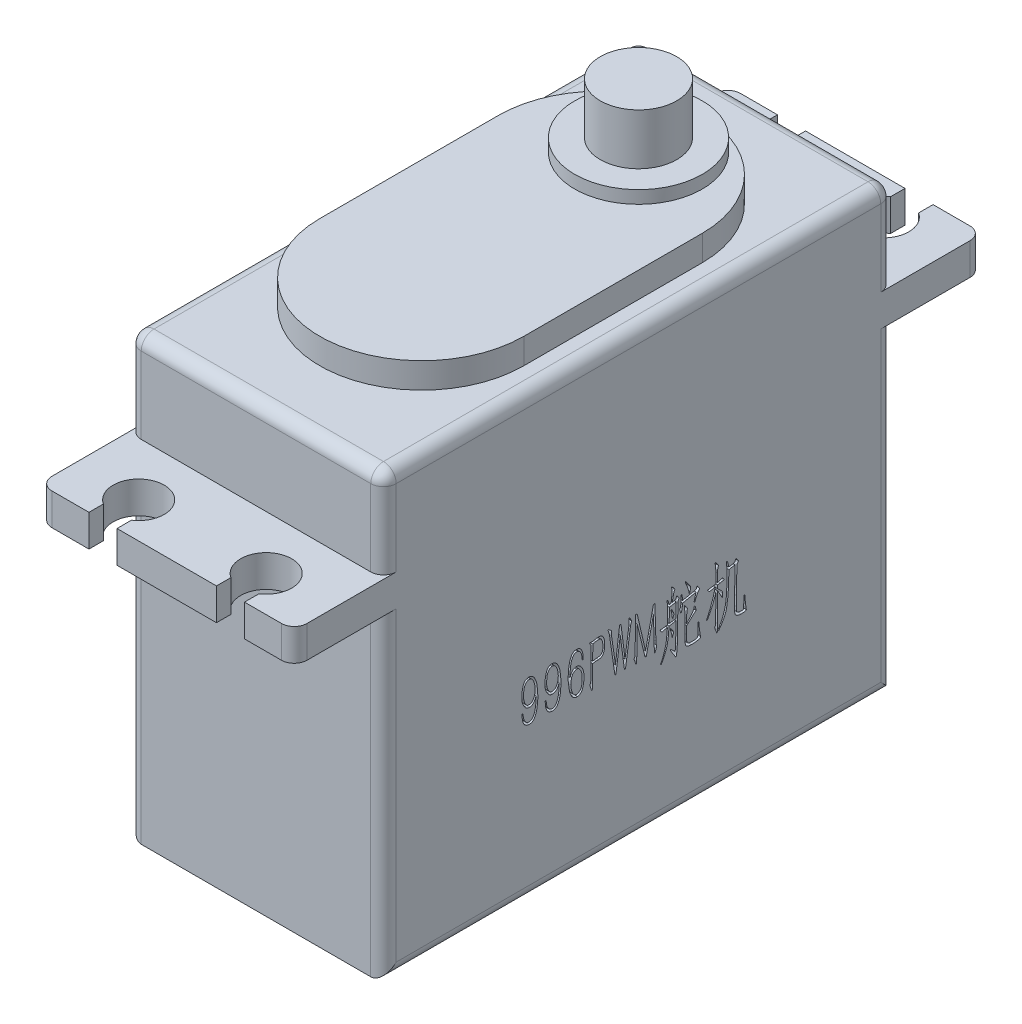
from build123d import *

# Parameters (mm, degrees)
SKETCH_1_W          = 20
SKETCH_1_H          = 40
EXTRUDE_1_DEPTH     = 34.5
EXTRUDE_2_DEPTH     = 2
EXTRUDE_3_DEPTH     = 2.5
SKETCH_4_R          = 5
EXTRUDE_4_DEPTH     = 1
SKETCH_5_R          = 3
EXTRUDE_5_DEPTH     = 4
FILLET_1_R          = 1
CUT_EXTRUDE_1_DEPTH = 4


with BuildPart() as part:
    # 草图1 → 凸台-拉伸1 (new body)
    with BuildSketch(Plane(origin=(0, 0, 0), x_dir=(1, 0, 0), z_dir=(0, 1, 0))):
        Rectangle(SKETCH_1_W, SKETCH_1_H)
    extrude(amount=EXTRUDE_1_DEPTH)

    # 草图2 → 凸台-拉伸2 (add)
    with BuildSketch(Plane(origin=(0, 34.5, 0), x_dir=(1, 0, 0), z_dir=(0, 1, 0))):
        with BuildLine():
            Line((-8, -7), (-8, 7))
            ThreePointArc((-8, 7), (0, 15), (8, 7))
            Line((8, 7), (8, -7))
            ThreePointArc((8, -7), (0, -15), (-8, -7))
        make_face()
    extrude(amount=EXTRUDE_2_DEPTH)

    # 草图3 → 凸台-拉伸3 (add)
    with BuildSketch(Plane(origin=(0, 25, 0), x_dir=(-1, 0, 0), z_dir=(0, -1, 0))):
        with BuildLine():
            Line((-6.1, 27), (-6.1, 25.870329309))
            ThreePointArc((-6.1, 25.870329309), (-5, 22.2), (-3.9, 25.870329309))
            Line((-3.9, 25.870329309), (-3.9, 27))
            Line((-3.9, 27), (3.9, 27))
            Line((3.9, 27), (3.9, 25.870329309))
            ThreePointArc((3.9, 25.870329309), (5, 22.2), (6.1, 25.870329309))
            Line((6.1, 25.870329309), (6.1, 27))
            Line((6.1, 27), (9, 27))
            ThreePointArc((9, 27), (9.707106781, 26.707106781), (10, 26))
            Line((10, 26), (10, -26))
            ThreePointArc((10, -26), (9.707106781, -26.707106781), (9, -27))
            Line((9, -27), (6.1, -27))
            Line((6.1, -27), (6.1, -25.870329309))
            ThreePointArc((6.1, -25.870329309), (5, -22.2), (3.9, -25.870329309))
            Line((3.9, -25.870329309), (3.9, -27))
            Line((3.9, -27), (-3.9, -27))
            Line((-3.9, -27), (-3.9, -25.870329309))
            ThreePointArc((-3.9, -25.870329309), (-5, -22.2), (-6.1, -25.870329309))
            Line((-6.1, -25.870329309), (-6.1, -27))
            Line((-6.1, -27), (-9, -27))
            ThreePointArc((-9, -27), (-9.707106781, -26.707106781), (-10, -26))
            Line((-10, -26), (-10, 26))
            ThreePointArc((-10, 26), (-9.707106781, 26.707106781), (-9, 27))
            Line((-9, 27), (-6.1, 27))
        make_face()
    extrude(amount=-EXTRUDE_3_DEPTH)

    # 草图4 → 凸台-拉伸4 (add)
    with BuildSketch(Plane(origin=(0, 36.5, 0), x_dir=(1, 0, 0), z_dir=(0, 1, 0))):
        with Locations(Location((0, 10, 0), (0, 0, 89.999408252))):
            Circle(SKETCH_4_R)
    extrude(amount=EXTRUDE_4_DEPTH)

    # 草图5 → 凸台-拉伸5 (add)
    with BuildSketch(Plane(origin=(0, 37.5, 0), x_dir=(1, 0, 0), z_dir=(0, 1, 0))):
        with Locations(Location((0, 10, 0), (0, 0, 270))):
            Circle(SKETCH_5_R)
    extrude(amount=EXTRUDE_5_DEPTH)

    # 圆角1
    fillet_1_edges = [part.edges().sort_by_distance(p)[0] for p in [
        (-10, 34.5, 0),
        (0, 34.5, 20),
        (10, 12.5, 20),
        (-10, 12.5, 20),
        (-10, 12.5, -20),
        (10, 12.5, -20),
        (10, 34.5, 0),
        (-10, 0, 0),
        (10, 0, 0),
        (0, 34.5, -20),
        (10, 31, 20),
        (-10, 31, 20),
        (-10, 31, -20),
        (10, 31, -20),
    ]]
    fillet(fillet_1_edges, radius=FILLET_1_R)

    # 草图6 → 切除-拉伸1 (cut)
    # profile 1 of 14: a face of its own
    with BuildSketch(Plane(origin=(10, 0, 0), x_dir=(0, 0, -1), z_dir=(1, 0, 0))):
        with BuildLine():
            Line((-9.128621836, 12.899167737), (-9.057771634, 12.899167737))
            add(Edge.make_bspline(
                [(-9.057771634, 12.899167737), (-9.055886692, 12.867841792), (-9.052187795, 12.806369646), (-9.044786482, 12.713535215), (-9.028669284, 12.617978955), (-9.007164207, 12.516078583), (-8.970553597, 12.410157527), (-8.924319271, 12.32538881), (-8.879231504, 12.26228251), (-8.842116522, 12.219666624), (-8.801841419, 12.182788809), (-8.759943312, 12.150226248), (-8.714354097, 12.125516926), (-8.666252746, 12.108846841), (-8.616159956, 12.099388656), (-8.564870773, 12.100422468), (-8.515268024, 12.105741613), (-8.469435926, 12.117402221), (-8.427702147, 12.131880321), (-8.389655362, 12.152712188), (-8.353710599, 12.182073927), (-8.318610879, 12.221481327), (-8.281146139, 12.270120341), (-8.243322302, 12.329143277), (-8.206451473, 12.397726809), (-8.172531679, 12.475898285), (-8.144226894, 12.563586375), (-8.11817375, 12.659127259), (-8.096330604, 12.762075934), (-8.076707978, 12.870174817), (-8.062018078, 12.983733215), (-8.054699832, 13.060981283), (-8.050952968, 13.10053147)],
                knots=[0, 0, 0, 0, 1.252559326, 2.457947003, 3.713841523, 5.117053957, 6.610613108, 8.168837215, 8.950770805, 9.703000201, 10.419099104, 11.127459157, 11.815519749, 12.477554054, 13.152836245, 13.837383191, 14.516661815, 15.139869337, 15.720479234, 16.275521832, 16.861195283, 17.563274806, 18.376854857, 19.309742631, 20.357286222, 21.481512078, 22.705053717, 24.031127874, 25.43219931, 26.903449425, 28.414599157, 30, 30, 30, 30], degree=3))
            Line((-8.050952968, 13.10053147), (-8.041257677, 13.397356528))
            Line((-8.041257677, 13.397356528), (-8.036037136, 13.59349972))
            add(Edge.make_bspline(
                [(-8.036037136, 13.59349972), (-8.043058007, 13.573540114), (-8.056299285, 13.535896538), (-8.077904747, 13.483658311), (-8.095983466, 13.437586119), (-8.11867752, 13.385364591), (-8.151967717, 13.326203064), (-8.199494684, 13.258151643), (-8.26155122, 13.193498089), (-8.324364641, 13.144782265), (-8.38318265, 13.110857149), (-8.434416533, 13.092827918), (-8.490557296, 13.082591451), (-8.529708085, 13.081142123), (-8.549887551, 13.080395097)],
                knots=[0, 0, 0, 0, 0.97538352, 1.839561457, 2.605830565, 3.257577491, 4.463312439, 5.729170022, 7.075015739, 8.578996452, 9.379480197, 10.195246693, 11.069777151, 12, 12, 12, 12], degree=3))
            add(Edge.make_bspline(
                [(-8.549887551, 13.080395097), (-8.579371518, 13.080522561), (-8.637614562, 13.080774357), (-8.723141579, 13.10533237), (-8.803666363, 13.150416662), (-8.864935215, 13.204579204), (-8.912580476, 13.257588989), (-8.947130752, 13.306031735), (-8.982738531, 13.359823593), (-9.027753526, 13.440955819), (-9.077080002, 13.549955892), (-9.112636092, 13.666147976), (-9.1310851, 13.764427702), (-9.14165772, 13.844326094), (-9.147246077, 13.930515147), (-9.14998435, 14.052662386), (-9.145677244, 14.206623299), (-9.13423552, 14.329145811), (-9.128621836, 14.389259362)],
                knots=[0, 0, 0, 0, 0.879728272, 1.737827631, 2.630970934, 3.623514444, 4.171975423, 4.763194427, 5.403395198, 6.103449893, 7.539853612, 8.979033516, 9.729610832, 10.533091785, 11.391417237, 12.314954855, 14.191996326, 16, 16, 16, 16], degree=3))
            add(Edge.make_bspline(
                [(-9.128621836, 14.389259362), (-9.125600526, 14.418909269), (-9.1193202, 14.480541845), (-9.100228478, 14.575394536), (-9.076562868, 14.676754115), (-9.047402495, 14.780831817), (-9.011995457, 14.880118583), (-8.965915237, 14.964815561), (-8.9119141, 15.032123606), (-8.849546617, 15.079297047), (-8.786885307, 15.110636613), (-8.731329245, 15.137860415), (-8.681268675, 15.155742615), (-8.649413647, 15.161510371), (-8.634907794, 15.16413684)],
                knots=[0, 0, 0, 0, 1.076048056, 2.236756268, 3.491455765, 4.836041697, 6.14043983, 7.290082288, 8.304241167, 9.232885901, 10.088674812, 10.831942243, 11.468100466, 12, 12, 12, 12], degree=3))
            add(Edge.make_bspline(
                [(-8.634907794, 15.16413684), (-8.610983916, 15.164788252), (-8.561939649, 15.166123657), (-8.499895275, 15.153264741), (-8.447926123, 15.136100916), (-8.405467908, 15.115044324), (-8.35900981, 15.089392897), (-8.311229045, 15.055734049), (-8.262909044, 15.016520327), (-8.218379851, 14.968557967), (-8.178259422, 14.913375768), (-8.131520661, 14.830423279), (-8.080842861, 14.72161338), (-8.034537476, 14.608736164), (-8.003132381, 14.510220871), (-7.983987784, 14.422191445), (-7.96487649, 14.321092158), (-7.951169506, 14.210803133), (-7.937219312, 14.102454625), (-7.926351003, 14.005431951), (-7.916982115, 13.924953961), (-7.909000178, 13.837704409), (-7.901332789, 13.73333549), (-7.897914812, 13.607687676), (-7.895640455, 13.485617491), (-7.895257097, 13.407550094), (-7.895082522, 13.371999614)],
                knots=[0, 0, 0, 0, 0.806713213, 1.653772819, 2.124104868, 2.654081555, 3.252335433, 3.916635636, 4.626710097, 5.351984771, 6.121747917, 6.927410151, 8.566108283, 10.176402668, 11.048110344, 12.05707717, 13.2190064, 14.525014517, 15.812180802, 16.911793298, 17.824881116, 18.550642389, 19.873117111, 21.361268186, 22.798369252, 24, 24, 24, 24], degree=3))
            add(Edge.make_bspline(
                [(-7.895082522, 13.371999614), (-7.898501882, 13.312563832), (-7.905031606, 13.19906326), (-7.919292501, 13.036173883), (-7.936623224, 12.88570822), (-7.95693775, 12.744184492), (-7.983985744, 12.607810786), (-8.019354538, 12.473589989), (-8.069435922, 12.338698051), (-8.123461866, 12.228467654), (-8.171921125, 12.143699332), (-8.212339964, 12.090454519), (-8.251618238, 12.045595215), (-8.305273721, 12.003541993), (-8.370304349, 11.967365669), (-8.445747158, 11.940529672), (-8.517060481, 11.930812746), (-8.562554917, 11.932025232), (-8.584939756, 11.932621817)],
                knots=[0, 0, 0, 0, 1.624069105, 3.1013771, 4.459964303, 5.755737869, 7.00065979, 8.250964146, 9.538458493, 10.918542601, 11.596633297, 12.197513324, 12.739940094, 13.217620638, 14.049588903, 14.759491509, 15.389626811, 16, 16, 16, 16], degree=3))
            add(Edge.make_bspline(
                [(-8.584939756, 11.932621817), (-8.604875508, 11.933923798), (-8.644042099, 11.936481724), (-8.701691623, 11.947876975), (-8.756672869, 11.966169045), (-8.80993279, 11.988814658), (-8.859797471, 12.018711514), (-8.904341868, 12.056816429), (-8.946266171, 12.099958681), (-8.981721684, 12.151690117), (-9.013714296, 12.209203951), (-9.042178136, 12.273091914), (-9.066454354, 12.343281803), (-9.087583516, 12.419673094), (-9.103654793, 12.503012074), (-9.116150853, 12.593382249), (-9.125318442, 12.690924312), (-9.127497763, 12.758440892), (-9.128621836, 12.793265329)],
                knots=[0, 0, 0, 0, 0.842437988, 1.65508804, 2.471183973, 3.283901732, 4.09349912, 4.912824997, 5.751334904, 6.624498646, 7.549677555, 8.526411442, 9.57150943, 10.681113351, 11.868197608, 13.150001712, 14.529996849, 16, 16, 16, 16], degree=3))
            Line((-9.128621836, 12.793265329), (-9.128621836, 12.899167737))
        make_face()
        with BuildLine():
            add(Edge.make_bspline(
                [(-8.106887338, 14.117045427), (-8.107912584, 14.162366266), (-8.109972486, 14.253423902), (-8.130797099, 14.390147953), (-8.162476389, 14.528226546), (-8.204711218, 14.640904375), (-8.24387205, 14.729146889), (-8.279871092, 14.789359775), (-8.3198562, 14.844006874), (-8.363902429, 14.892361767), (-8.412908554, 14.932745914), (-8.467652613, 14.961154576), (-8.527665035, 14.976496137), (-8.568944524, 14.977284008), (-8.590160298, 14.977688938)],
                knots=[0, 0, 0, 0, 1.505269767, 3.024355023, 4.587563069, 6.205561773, 7.015225436, 7.793196006, 8.531914046, 9.262827526, 9.96223762, 10.631110954, 11.296453508, 12, 12, 12, 12], degree=3))
            add(Edge.make_bspline(
                [(-8.590160298, 14.977688938), (-8.609206498, 14.97598602), (-8.647660125, 14.972547886), (-8.703394246, 14.95272238), (-8.757342296, 14.923096337), (-8.807486938, 14.883055723), (-8.853152461, 14.836609849), (-8.892761982, 14.785676944), (-8.923095933, 14.730013407), (-8.946848504, 14.67062522), (-8.962974868, 14.606357986), (-8.978192619, 14.537513053), (-8.990661812, 14.462815394), (-9.004182025, 14.357712467), (-9.014476455, 14.227323744), (-9.023443855, 14.099264524), (-9.022971957, 13.998572815), (-9.016041428, 13.920519919), (-9.00250935, 13.838576884), (-8.989258247, 13.783105227), (-8.982446682, 13.754590707)],
                knots=[0, 0, 0, 0, 0.723025022, 1.45976281, 2.223828234, 3.050262287, 3.883984448, 4.691414973, 5.489369132, 6.281055072, 7.111623335, 7.99965266, 8.956403863, 9.983603313, 12.019426915, 13.918133557, 14.851967774, 15.836581553, 16.887921472, 18, 18, 18, 18], degree=3))
            add(Edge.make_bspline(
                [(-8.982446682, 13.754590707), (-8.977212794, 13.730590158), (-8.966781399, 13.682755884), (-8.942604075, 13.613759972), (-8.916590992, 13.54605344), (-8.883991272, 13.4831922), (-8.848734904, 13.426236952), (-8.812057344, 13.377192145), (-8.772678808, 13.338784765), (-8.732916661, 13.308575955), (-8.690601381, 13.288255053), (-8.646965615, 13.274482094), (-8.60098355, 13.268259458), (-8.570027761, 13.270290115), (-8.554362301, 13.271317747)],
                knots=[0, 0, 0, 0, 1.249295129, 2.489906676, 3.716627194, 4.939162725, 6.087456956, 7.125272735, 8.04703053, 8.879787111, 9.655179009, 10.423724505, 11.202311359, 12, 12, 12, 12], degree=3))
            add(Edge.make_bspline(
                [(-8.554362301, 13.271317747), (-8.5356034, 13.272875787), (-8.498695495, 13.275941211), (-8.445981221, 13.292169909), (-8.397270556, 13.316606925), (-8.352762976, 13.348680406), (-8.313434347, 13.38691887), (-8.277143212, 13.426673995), (-8.247299714, 13.469917016), (-8.221153377, 13.515758128), (-8.19884408, 13.5666953), (-8.178179579, 13.6233037), (-8.158638159, 13.68649991), (-8.140962005, 13.7566711), (-8.124470565, 13.834569575), (-8.115113438, 13.921225925), (-8.107916016, 14.016242255), (-8.107240139, 14.08247344), (-8.106887338, 14.117045427)],
                knots=[0, 0, 0, 0, 0.858534186, 1.689155361, 2.502410263, 3.341387375, 4.185583203, 5.006741642, 5.798181287, 6.581994594, 7.416339851, 8.336881895, 9.336277953, 10.438915224, 11.644792309, 12.972767156, 14.419816086, 16, 16, 16, 16], degree=3))
        make_face(mode=Mode.SUBTRACT)
    # profile 2 of 14: a face of its own
    with BuildSketch(Plane(origin=(10, 0, 0), x_dir=(0, 0, -1), z_dir=(1, 0, 0))):
        with BuildLine():
            Line((-7.314856654, 12.899167737), (-7.244006452, 12.899167737))
            add(Edge.make_bspline(
                [(-7.244006452, 12.899167737), (-7.24212151, 12.867841792), (-7.238422613, 12.806369646), (-7.2310213, 12.713535215), (-7.214904102, 12.617978955), (-7.193399025, 12.516078583), (-7.156788415, 12.410157527), (-7.110554089, 12.32538881), (-7.065466322, 12.26228251), (-7.02835134, 12.219666624), (-6.988076237, 12.182788809), (-6.946178129, 12.150226248), (-6.900588915, 12.125516926), (-6.852487563, 12.108846841), (-6.802394773, 12.099388656), (-6.75110559, 12.100422468), (-6.701502841, 12.105741613), (-6.655670743, 12.117402221), (-6.613936965, 12.131880321), (-6.57589018, 12.152712188), (-6.539945417, 12.182073927), (-6.504845697, 12.221481327), (-6.467380956, 12.270120341), (-6.42955712, 12.329143277), (-6.392686291, 12.397726809), (-6.358766496, 12.475898285), (-6.330461712, 12.563586375), (-6.304408568, 12.659127259), (-6.282565422, 12.762075934), (-6.262942796, 12.870174817), (-6.248252896, 12.983733215), (-6.24093465, 13.060981283), (-6.237187785, 13.10053147)],
                knots=[0, 0, 0, 0, 1.252559326, 2.457947003, 3.713841523, 5.117053957, 6.610613108, 8.168837215, 8.950770805, 9.703000201, 10.419099104, 11.127459157, 11.815519749, 12.477554054, 13.152836245, 13.837383191, 14.516661815, 15.139869337, 15.720479234, 16.275521832, 16.861195283, 17.563274806, 18.376854857, 19.309742631, 20.357286222, 21.481512078, 22.705053717, 24.031127874, 25.43219931, 26.903449425, 28.414599157, 30, 30, 30, 30], degree=3))
            Line((-6.237187785, 13.10053147), (-6.227492495, 13.397356528))
            Line((-6.227492495, 13.397356528), (-6.222271953, 13.59349972))
            add(Edge.make_bspline(
                [(-6.222271953, 13.59349972), (-6.229292825, 13.573540114), (-6.242534103, 13.535896538), (-6.264139565, 13.483658311), (-6.282218284, 13.437586119), (-6.304912337, 13.385364591), (-6.338202535, 13.326203064), (-6.385729501, 13.258151643), (-6.447786037, 13.193498089), (-6.510599459, 13.144782265), (-6.569417468, 13.110857149), (-6.620651351, 13.092827918), (-6.676792114, 13.082591451), (-6.715942903, 13.081142123), (-6.736122369, 13.080395097)],
                knots=[0, 0, 0, 0, 0.97538352, 1.839561457, 2.605830565, 3.257577491, 4.463312439, 5.729170022, 7.075015739, 8.578996452, 9.379480197, 10.195246693, 11.069777151, 12, 12, 12, 12], degree=3))
            add(Edge.make_bspline(
                [(-6.736122369, 13.080395097), (-6.765606336, 13.080522561), (-6.82384938, 13.080774357), (-6.909376397, 13.10533237), (-6.989901181, 13.150416662), (-7.051170033, 13.204579204), (-7.098815294, 13.257588989), (-7.13336557, 13.306031735), (-7.168973349, 13.359823593), (-7.213988344, 13.440955819), (-7.26331482, 13.549955892), (-7.29887091, 13.666147976), (-7.317319918, 13.764427702), (-7.327892537, 13.844326094), (-7.333480895, 13.930515147), (-7.336219168, 14.052662386), (-7.331912062, 14.206623299), (-7.320470338, 14.329145811), (-7.314856654, 14.389259362)],
                knots=[0, 0, 0, 0, 0.879728272, 1.737827631, 2.630970934, 3.623514444, 4.171975423, 4.763194427, 5.403395198, 6.103449893, 7.539853612, 8.979033516, 9.729610832, 10.533091785, 11.391417237, 12.314954855, 14.191996326, 16, 16, 16, 16], degree=3))
            add(Edge.make_bspline(
                [(-7.314856654, 14.389259362), (-7.311835344, 14.418909269), (-7.305555018, 14.480541845), (-7.286463296, 14.575394536), (-7.262797686, 14.676754115), (-7.233637313, 14.780831817), (-7.198230275, 14.880118583), (-7.152150055, 14.964815561), (-7.098148918, 15.032123606), (-7.035781435, 15.079297047), (-6.973120125, 15.110636613), (-6.917564063, 15.137860415), (-6.867503493, 15.155742615), (-6.835648465, 15.161510371), (-6.821142612, 15.16413684)],
                knots=[0, 0, 0, 0, 1.076048056, 2.236756268, 3.491455765, 4.836041697, 6.14043983, 7.290082288, 8.304241167, 9.232885901, 10.088674812, 10.831942243, 11.468100466, 12, 12, 12, 12], degree=3))
            add(Edge.make_bspline(
                [(-6.821142612, 15.16413684), (-6.797218734, 15.164788252), (-6.748174467, 15.166123657), (-6.686130093, 15.153264741), (-6.634160941, 15.136100916), (-6.591702726, 15.115044324), (-6.545244628, 15.089392897), (-6.497463863, 15.055734049), (-6.449143862, 15.016520327), (-6.404614669, 14.968557967), (-6.364494239, 14.913375768), (-6.317755479, 14.830423279), (-6.267077679, 14.72161338), (-6.220772294, 14.608736164), (-6.189367199, 14.510220871), (-6.170222602, 14.422191445), (-6.151111308, 14.321092158), (-6.137404323, 14.210803133), (-6.12345413, 14.102454625), (-6.112585821, 14.005431951), (-6.103216933, 13.924953961), (-6.095234996, 13.837704409), (-6.087567606, 13.73333549), (-6.08414963, 13.607687676), (-6.081875272, 13.485617491), (-6.081491914, 13.407550094), (-6.08131734, 13.371999614)],
                knots=[0, 0, 0, 0, 0.806713213, 1.653772819, 2.124104868, 2.654081555, 3.252335433, 3.916635636, 4.626710097, 5.351984771, 6.121747917, 6.927410151, 8.566108283, 10.176402668, 11.048110344, 12.05707717, 13.2190064, 14.525014517, 15.812180802, 16.911793298, 17.824881116, 18.550642389, 19.873117111, 21.361268186, 22.798369252, 24, 24, 24, 24], degree=3))
            add(Edge.make_bspline(
                [(-6.08131734, 13.371999614), (-6.0847367, 13.312563832), (-6.091266424, 13.19906326), (-6.105527318, 13.036173883), (-6.122858041, 12.88570822), (-6.143172568, 12.744184492), (-6.170220562, 12.607810786), (-6.205589356, 12.473589989), (-6.255670739, 12.338698051), (-6.309696684, 12.228467654), (-6.358155943, 12.143699332), (-6.398574782, 12.090454519), (-6.437853056, 12.045595215), (-6.491508538, 12.003541993), (-6.556539167, 11.967365669), (-6.631981976, 11.940529672), (-6.703295299, 11.930812746), (-6.748789735, 11.932025232), (-6.771174574, 11.932621817)],
                knots=[0, 0, 0, 0, 1.624069105, 3.1013771, 4.459964303, 5.755737869, 7.00065979, 8.250964146, 9.538458493, 10.918542601, 11.596633297, 12.197513324, 12.739940094, 13.217620638, 14.049588903, 14.759491509, 15.389626811, 16, 16, 16, 16], degree=3))
            add(Edge.make_bspline(
                [(-6.771174574, 11.932621817), (-6.791110326, 11.933923798), (-6.830276917, 11.936481724), (-6.887926441, 11.947876975), (-6.942907687, 11.966169045), (-6.996167608, 11.988814658), (-7.046032289, 12.018711514), (-7.090576686, 12.056816429), (-7.132500989, 12.099958681), (-7.167956502, 12.151690117), (-7.199949114, 12.209203951), (-7.228412953, 12.273091914), (-7.252689172, 12.343281803), (-7.273818334, 12.419673094), (-7.289889611, 12.503012074), (-7.302385671, 12.593382249), (-7.31155326, 12.690924312), (-7.31373258, 12.758440892), (-7.314856654, 12.793265329)],
                knots=[0, 0, 0, 0, 0.842437988, 1.65508804, 2.471183973, 3.283901732, 4.09349912, 4.912824997, 5.751334904, 6.624498646, 7.549677555, 8.526411442, 9.57150943, 10.681113351, 11.868197608, 13.150001712, 14.529996849, 16, 16, 16, 16], degree=3))
            Line((-7.314856654, 12.793265329), (-7.314856654, 12.899167737))
        make_face()
        with BuildLine():
            add(Edge.make_bspline(
                [(-6.293122156, 14.117045427), (-6.294147402, 14.162366266), (-6.296207304, 14.253423902), (-6.317031917, 14.390147953), (-6.348711207, 14.528226546), (-6.390946036, 14.640904375), (-6.430106868, 14.729146889), (-6.46610591, 14.789359775), (-6.506091018, 14.844006874), (-6.550137247, 14.892361767), (-6.599143372, 14.932745914), (-6.653887431, 14.961154576), (-6.713899853, 14.976496137), (-6.755179342, 14.977284008), (-6.776395116, 14.977688938)],
                knots=[0, 0, 0, 0, 1.505269767, 3.024355023, 4.587563069, 6.205561773, 7.015225436, 7.793196006, 8.531914046, 9.262827526, 9.96223762, 10.631110954, 11.296453508, 12, 12, 12, 12], degree=3))
            add(Edge.make_bspline(
                [(-6.776395116, 14.977688938), (-6.795441316, 14.97598602), (-6.833894943, 14.972547886), (-6.889629064, 14.95272238), (-6.943577114, 14.923096337), (-6.993721756, 14.883055723), (-7.039387279, 14.836609849), (-7.0789968, 14.785676944), (-7.109330751, 14.730013407), (-7.133083322, 14.67062522), (-7.149209686, 14.606357986), (-7.164427437, 14.537513053), (-7.17689663, 14.462815394), (-7.190416843, 14.357712467), (-7.200711273, 14.227323744), (-7.209678673, 14.099264524), (-7.209206774, 13.998572815), (-7.202276246, 13.920519919), (-7.188744168, 13.838576884), (-7.175493065, 13.783105227), (-7.168681499, 13.754590707)],
                knots=[0, 0, 0, 0, 0.723025022, 1.45976281, 2.223828234, 3.050262287, 3.883984448, 4.691414973, 5.489369132, 6.281055072, 7.111623335, 7.99965266, 8.956403863, 9.983603313, 12.019426915, 13.918133557, 14.851967774, 15.836581553, 16.887921472, 18, 18, 18, 18], degree=3))
            add(Edge.make_bspline(
                [(-7.168681499, 13.754590707), (-7.163447612, 13.730590158), (-7.153016217, 13.682755884), (-7.128838893, 13.613759972), (-7.10282581, 13.54605344), (-7.070226089, 13.4831922), (-7.034969722, 13.426236952), (-6.998292162, 13.377192145), (-6.958913625, 13.338784765), (-6.919151479, 13.308575955), (-6.876836199, 13.288255053), (-6.833200432, 13.274482094), (-6.787218367, 13.268259458), (-6.756262579, 13.270290115), (-6.740597118, 13.271317747)],
                knots=[0, 0, 0, 0, 1.249295129, 2.489906676, 3.716627194, 4.939162725, 6.087456956, 7.125272735, 8.04703053, 8.879787111, 9.655179009, 10.423724505, 11.202311359, 12, 12, 12, 12], degree=3))
            add(Edge.make_bspline(
                [(-6.740597118, 13.271317747), (-6.721838218, 13.272875787), (-6.684930313, 13.275941211), (-6.632216039, 13.292169909), (-6.583505374, 13.316606925), (-6.538997794, 13.348680406), (-6.499669165, 13.38691887), (-6.46337803, 13.426673995), (-6.433534532, 13.469917016), (-6.407388195, 13.515758128), (-6.385078898, 13.5666953), (-6.364414397, 13.6233037), (-6.344872976, 13.68649991), (-6.327196823, 13.7566711), (-6.310705382, 13.834569575), (-6.301348256, 13.921225925), (-6.294150834, 14.016242255), (-6.293474957, 14.08247344), (-6.293122156, 14.117045427)],
                knots=[0, 0, 0, 0, 0.858534186, 1.689155361, 2.502410263, 3.341387375, 4.185583203, 5.006741642, 5.798181287, 6.581994594, 7.416339851, 8.336881895, 9.336277953, 10.438915224, 11.644792309, 12.972767156, 14.419816086, 16, 16, 16, 16], degree=3))
        make_face(mode=Mode.SUBTRACT)
    # profile 3 of 14: a face of its own
    with BuildSketch(Plane(origin=(10, 0, 0), x_dir=(0, 0, -1), z_dir=(1, 0, 0))):
        with BuildLine():
            Line((-4.33840236, 14.217727293), (-4.408506771, 14.217727293))
            add(Edge.make_bspline(
                [(-4.408506771, 14.217727293), (-4.413298349, 14.247767336), (-4.422778743, 14.307203177), (-4.431510509, 14.39802684), (-4.442159325, 14.492401167), (-4.460392002, 14.59225765), (-4.489078925, 14.696074291), (-4.52942943, 14.778607176), (-4.567601043, 14.840449044), (-4.600142819, 14.881804392), (-4.637476338, 14.916445763), (-4.677379575, 14.945608915), (-4.720350114, 14.968156015), (-4.765400772, 14.984425587), (-4.813212065, 14.991704442), (-4.861875587, 14.991245931), (-4.909257235, 14.985727641), (-4.953268514, 14.974252127), (-4.992952818, 14.958717564), (-5.029789856, 14.938147536), (-5.063591182, 14.90840177), (-5.098848122, 14.871125262), (-5.134216376, 14.822534768), (-5.171236823, 14.765142434), (-5.207116354, 14.69810714), (-5.238771661, 14.62179881), (-5.267039448, 14.537283746), (-5.299867884, 14.412385796), (-5.330308527, 14.244682587), (-5.348564808, 14.073103506), (-5.357196703, 13.938347365), (-5.361480666, 13.848081716), (-5.364993264, 13.769782317), (-5.365242912, 13.72153039), (-5.3653574, 13.699402128)],
                knots=[0, 0, 0, 0, 1.172618578, 2.320089015, 3.517365984, 4.833421129, 6.231766425, 7.655217032, 8.357323983, 9.032478261, 9.676711985, 10.315215253, 10.932648665, 11.54199308, 12.153444918, 12.786093219, 13.413857257, 13.988112725, 14.53457488, 15.054145165, 15.605211832, 16.262994999, 17.029841423, 17.917944275, 18.895673466, 19.956732694, 21.09950916, 22.329492637, 24.933332206, 27.662278065, 28.97833321, 30.139613505, 31.146829503, 32, 32, 32, 32], degree=3))
            Line((-5.3653574, 13.699402128), (-5.369832149, 13.503258936))
            add(Edge.make_bspline(
                [(-5.369832149, 13.503258936), (-5.35738273, 13.538387385), (-5.334880243, 13.601882511), (-5.300330077, 13.689485736), (-5.261208306, 13.763769284), (-5.21560223, 13.832458857), (-5.156584617, 13.895855956), (-5.0962949, 13.942174461), (-5.039604288, 13.974190128), (-4.989261112, 13.992538394), (-4.932578174, 14.005212963), (-4.892589728, 14.00910456), (-4.871643358, 14.011143019)],
                knots=[0, 0, 0, 0, 1.463710204, 2.645675197, 3.693667506, 4.755032446, 5.874045908, 7.078730407, 7.725382873, 8.423483439, 9.174203962, 10, 10, 10, 10], degree=3))
            add(Edge.make_bspline(
                [(-4.871643358, 14.011143019), (-4.841382109, 14.009985865), (-4.783833563, 14.007785276), (-4.700984557, 13.983016508), (-4.623533307, 13.939553126), (-4.563872852, 13.886409201), (-4.515711037, 13.833962399), (-4.480236929, 13.785936267), (-4.445620485, 13.731611923), (-4.401125122, 13.650210031), (-4.353144444, 13.53919594), (-4.318475665, 13.420570267), (-4.30046712, 13.320061161), (-4.288724466, 13.239045669), (-4.282506057, 13.152582389), (-4.278882622, 13.031704388), (-4.280658509, 12.880833218), (-4.288885701, 12.760920208), (-4.292909072, 12.702278753)],
                knots=[0, 0, 0, 0, 0.909148716, 1.728949998, 2.576991438, 3.564625719, 4.121218537, 4.72026629, 5.360049571, 6.060456872, 7.512703724, 8.993852322, 9.770776208, 10.587253518, 11.458483217, 12.380006039, 14.229702395, 16, 16, 16, 16], degree=3))
            add(Edge.make_bspline(
                [(-4.292909072, 12.702278753), (-4.297609119, 12.671901312), (-4.307356913, 12.608899171), (-4.328011676, 12.511712459), (-4.353348744, 12.408481402), (-4.382457267, 12.302991181), (-4.416161108, 12.20282824), (-4.460750917, 12.117470407), (-4.51467791, 12.050458709), (-4.576987405, 12.004259779), (-4.638524078, 11.973816655), (-4.693559773, 11.950249121), (-4.74146436, 11.933240973), (-4.772108699, 11.929211662), (-4.785877323, 11.927401276)],
                knots=[0, 0, 0, 0, 1.110217054, 2.302565578, 3.587623031, 4.949459538, 6.256081064, 7.397105523, 8.411240029, 9.334418742, 10.173869837, 10.886090718, 11.499516107, 12, 12, 12, 12], degree=3))
            add(Edge.make_bspline(
                [(-4.785877323, 11.927401276), (-4.811003439, 11.925294874), (-4.861099021, 11.921095203), (-4.924369325, 11.932588399), (-4.97510747, 11.950301195), (-5.016224358, 11.971469334), (-5.061918504, 11.9971127), (-5.109528917, 12.030598672), (-5.157902384, 12.069548077), (-5.201188139, 12.117668483), (-5.241075846, 12.171388389), (-5.287064921, 12.252676355), (-5.335432896, 12.360533839), (-5.380307047, 12.472519588), (-5.40919366, 12.57160885), (-5.428779578, 12.660359552), (-5.447301131, 12.763375603), (-5.463301654, 12.875666868), (-5.477418286, 12.986619364), (-5.489218323, 13.086105618), (-5.499198722, 13.168829425), (-5.508279151, 13.256753543), (-5.51461376, 13.354492205), (-5.516661423, 13.469696979), (-5.514700778, 13.591035732), (-5.512142035, 13.67504296), (-5.510786763, 13.719538502)],
                knots=[0, 0, 0, 0, 0.848219995, 1.691151707, 2.144998995, 2.659153853, 3.249319417, 3.912736756, 4.621867519, 5.340468245, 6.090710837, 6.87657341, 8.487178015, 10.078339935, 10.944022033, 11.968008362, 13.14490399, 14.476453821, 15.796264219, 16.920399402, 17.85823784, 18.608902694, 19.903936842, 21.162934464, 22.497310667, 24, 24, 24, 24], degree=3))
            add(Edge.make_bspline(
                [(-5.510786763, 13.719538502), (-5.509889377, 13.755091353), (-5.508200976, 13.821982892), (-5.504379818, 13.915953041), (-5.500432676, 13.99706659), (-5.491986991, 14.090118397), (-5.47807243, 14.204133453), (-5.456131473, 14.343656072), (-5.430389208, 14.483621061), (-5.402326089, 14.596168207), (-5.375321974, 14.682307259), (-5.349940001, 14.748198321), (-5.31803848, 14.815669756), (-5.283381636, 14.885115598), (-5.243804635, 14.951088811), (-5.200222873, 15.010411371), (-5.153181931, 15.060497378), (-5.102827287, 15.102897003), (-5.045988558, 15.134929473), (-4.982557684, 15.15756526), (-4.911609659, 15.169292527), (-4.862235393, 15.169335211), (-4.836591152, 15.169357381)],
                knots=[0, 0, 0, 0, 1.211628523, 2.279639787, 3.204225299, 3.977932759, 5.462339825, 7.116605252, 8.789327199, 10.30942825, 11.064792467, 11.863814246, 12.712679163, 13.606614715, 14.50718602, 15.330439464, 16.109367713, 16.843542067, 17.564206182, 18.319665359, 19.127259812, 20, 20, 20, 20], degree=3))
            add(Edge.make_bspline(
                [(-4.836591152, 15.169357381), (-4.810599955, 15.167205741), (-4.76148381, 15.163139738), (-4.69378392, 15.144705264), (-4.635629795, 15.120227125), (-4.58959175, 15.085528621), (-4.553462422, 15.047265331), (-4.520076852, 15.012509729), (-4.4938163, 14.977291522), (-4.470975901, 14.94274538), (-4.452086948, 14.904389446), (-4.433166657, 14.861014745), (-4.415665754, 14.809969827), (-4.398653073, 14.75414615), (-4.382772383, 14.697937581), (-4.369246969, 14.645740541), (-4.358776128, 14.599729627), (-4.348177845, 14.544227359), (-4.33939332, 14.471321992), (-4.338751589, 14.411417931), (-4.33840236, 14.37881828)],
                knots=[0, 0, 0, 0, 1.358046768, 2.566331314, 3.646368544, 4.629682629, 5.546946845, 6.391627168, 7.141431054, 7.835891544, 8.549473584, 9.368770778, 10.304200405, 11.362836174, 12.414134618, 13.351720444, 14.176238426, 14.875889185, 16.299866179, 18, 18, 18, 18], degree=3))
            Line((-4.33840236, 14.37881828), (-4.33840236, 14.217727293))
        make_face()
        with BuildLine():
            add(Edge.make_bspline(
                [(-5.30494828, 12.974492689), (-5.303440382, 12.929694567), (-5.300345688, 12.837754304), (-5.281541206, 12.698313301), (-5.24884621, 12.556843984), (-5.209775566, 12.440919749), (-5.171017601, 12.35231626), (-5.136199372, 12.2924782), (-5.098450282, 12.237954681), (-5.055277999, 12.191135113), (-5.007801717, 12.151375472), (-4.952938632, 12.126336216), (-4.893541214, 12.111581901), (-4.852587505, 12.113075426), (-4.831370611, 12.113849177)],
                knots=[0, 0, 0, 0, 1.4886747, 3.055242853, 4.666194597, 6.306608966, 7.112592917, 7.87485258, 8.603662743, 9.310999056, 9.986965693, 10.644668568, 11.297843225, 12, 12, 12, 12], degree=3))
            add(Edge.make_bspline(
                [(-4.831370611, 12.113849177), (-4.81307301, 12.115583584), (-4.776398776, 12.119059889), (-4.723141489, 12.1382053), (-4.671937377, 12.16684707), (-4.623883222, 12.205967735), (-4.58022841, 12.252180094), (-4.541374327, 12.303398403), (-4.50997431, 12.359711485), (-4.477156495, 12.442519933), (-4.446882307, 12.556033166), (-4.430230319, 12.702416814), (-4.41997891, 12.855557644), (-4.412073768, 13.013367712), (-4.413864106, 13.176933468), (-4.433492424, 13.286153509), (-4.443558977, 13.34216795)],
                knots=[0, 0, 0, 0, 0.542441635, 1.087226227, 1.660703064, 2.273516638, 2.914006631, 3.539772715, 4.172601069, 4.816509057, 6.173746714, 7.636628278, 9.17189136, 10.71932084, 12.317475397, 14, 14, 14, 14], degree=3))
            add(Edge.make_bspline(
                [(-4.443558977, 13.34216795), (-4.457224105, 13.388108017), (-4.484376538, 13.479390331), (-4.536200718, 13.585580242), (-4.58428455, 13.661419097), (-4.61982712, 13.710881456), (-4.659524632, 13.749000709), (-4.69901338, 13.779739232), (-4.740281883, 13.80120457), (-4.78121426, 13.817875008), (-4.823901795, 13.825080021), (-4.85223677, 13.825320508), (-4.866422816, 13.825440909)],
                knots=[0, 0, 0, 0, 2.076888393, 4.126750173, 5.096135134, 5.973977047, 6.759453719, 7.47553224, 8.136547057, 8.771446398, 9.384918551, 10, 10, 10, 10], degree=3))
            add(Edge.make_bspline(
                [(-4.866422816, 13.825440909), (-4.883706777, 13.822766926), (-4.918509746, 13.817382595), (-4.968652236, 13.799010444), (-5.0167143, 13.772321935), (-5.074944975, 13.72610549), (-5.138693923, 13.661441146), (-5.187977563, 13.586825246), (-5.216997254, 13.521138439), (-5.237786531, 13.464947802), (-5.256182498, 13.400032172), (-5.273271898, 13.327693554), (-5.287293328, 13.248032643), (-5.297790077, 13.162171171), (-5.303542158, 13.070281345), (-5.304470116, 13.007066457), (-5.30494828, 12.974492689)],
                knots=[0, 0, 0, 0, 0.703513377, 1.416593983, 2.138698186, 2.910269809, 4.405335412, 5.780974721, 6.484987373, 7.296510348, 8.193863016, 9.202460595, 10.29132512, 11.452082192, 12.687092747, 14, 14, 14, 14], degree=3))
        make_face(mode=Mode.SUBTRACT)
    # profile 4 of 14: a face of its own
    with BuildSketch(Plane(origin=(10, 0, 0), x_dir=(0, 0, -1), z_dir=(1, 0, 0))):
        with BuildLine():
            add(Edge.make_bspline(
                [(-3.556066967, 15.083591346), (-3.517496186, 15.090107852), (-3.443490102, 15.102611125), (-3.336083941, 15.124014925), (-3.232413004, 15.142076353), (-3.163352943, 15.146835113), (-3.128728378, 15.149221007)],
                knots=[0, 0, 0, 0, 1.084781132, 2.081378719, 3.038062992, 4, 4, 4, 4], degree=3))
            add(Edge.make_bspline(
                [(-3.128728378, 15.149221007), (-3.10882541, 15.149650849), (-3.070925314, 15.150469372), (-3.017256463, 15.144983024), (-2.969312297, 15.136050019), (-2.926930828, 15.119642944), (-2.88802105, 15.09747196), (-2.85074558, 15.068227692), (-2.814486113, 15.03164343), (-2.779126513, 14.987140627), (-2.746069179, 14.934319079), (-2.718726976, 14.871129038), (-2.695424898, 14.798790625), (-2.674704308, 14.690635603), (-2.654393527, 14.554319826), (-2.647382936, 14.419926291), (-2.64711349, 14.31937154), (-2.650076627, 14.250690378), (-2.655654194, 14.187145429), (-2.662367216, 14.146844776), (-2.665591791, 14.127486509)],
                knots=[0, 0, 0, 0, 0.834042403, 1.588219797, 2.258865872, 2.872645434, 3.484296274, 4.130763207, 4.85321558, 5.639635085, 6.510463327, 7.457868132, 8.519533185, 9.691141985, 12.070813463, 14.294972691, 15.327100164, 16.287155067, 17.177241371, 18, 18, 18, 18], degree=3))
            add(Edge.make_bspline(
                [(-2.665591791, 14.127486509), (-2.669698997, 14.104779946), (-2.677705029, 14.060518838), (-2.695510065, 13.997301278), (-2.714230533, 13.937839416), (-2.737573509, 13.884110369), (-2.762097732, 13.834651329), (-2.789570887, 13.791137771), (-2.818719449, 13.752151857), (-2.86064062, 13.709769199), (-2.916946558, 13.666879526), (-2.990753138, 13.633853319), (-3.065387713, 13.617904902), (-3.11449908, 13.615034439), (-3.138423669, 13.613636094)],
                knots=[0, 0, 0, 0, 1.080384674, 2.105956013, 3.074594822, 3.998289199, 4.84730105, 5.658400013, 6.406150959, 7.122683501, 8.445750941, 9.696890862, 10.878041055, 12, 12, 12, 12], degree=3))
            Line((-3.138423669, 13.613636094), (-3.334566861, 13.603940803))
            Line((-3.334566861, 13.603940803), (-3.596339714, 13.568142806))
            Line((-3.596339714, 13.568142806), (-3.601560255, 12.219005793))
            add(Edge.make_bspline(
                [(-3.601560255, 12.219005793), (-3.602126524, 12.189166932), (-3.603146059, 12.135443732), (-3.606833487, 12.063900605), (-3.608189006, 12.00986345), (-3.612677027, 11.9599555), (-3.617859822, 11.904760977), (-3.625180701, 11.852220473), (-3.630847338, 11.810620226), (-3.636836221, 11.791089518), (-3.642153325, 11.774488705), (-3.649574701, 11.775601003), (-3.652274084, 11.77600558)],
                knots=[0, 0, 0, 0, 1.96874048, 3.54460707, 4.726507013, 5.532831549, 6.851459339, 8.37313705, 9.071482733, 9.549088405, 9.835989539, 10, 10, 10, 10], degree=3))
            add(Edge.make_bspline(
                [(-3.652274084, 11.77600558), (-3.653263076, 11.776756392), (-3.657496201, 11.779970052), (-3.667837917, 11.786677047), (-3.67835654, 11.805998334), (-3.683950585, 11.822176998), (-3.68732629, 11.831939951)],
                knots=[0, 0, 0, 0, 0.220639879, 0.944392497, 2.156105254, 4, 4, 4, 4], degree=3))
            Line((-3.68732629, 11.831939951), (-3.712683204, 11.89682382))
            Line((-3.712683204, 11.89682382), (-3.773092324, 12.07805118))
            add(Edge.make_bspline(
                [(-3.773092324, 12.07805118), (-3.778726182, 12.095466795), (-3.788543149, 12.125813414), (-3.802182327, 12.164768807), (-3.808851376, 12.191069066), (-3.812636144, 12.211687863), (-3.803566651, 12.232108499), (-3.792161094, 12.259860696), (-3.776416177, 12.2962062), (-3.765116917, 12.3410827), (-3.754332394, 12.389108449), (-3.744559016, 12.439717579), (-3.738521418, 12.495291969), (-3.736937368, 12.548384958), (-3.737732822, 12.600863074), (-3.735197354, 12.653289568), (-3.735489282, 12.716964679), (-3.733753148, 12.763188747), (-3.732819577, 12.788044788)],
                knots=[0, 0, 0, 0, 1.21093634, 2.110050319, 2.719907809, 3.017552618, 3.464624392, 4.142243825, 5.027278712, 6.067997939, 7.196380019, 8.282686609, 9.473265847, 10.887508473, 11.791416163, 12.942313598, 14.355792079, 16, 16, 16, 16], degree=3))
            Line((-3.732819577, 12.788044788), (-3.722378495, 14.86209124))
            add(Edge.make_bspline(
                [(-3.722378495, 14.86209124), (-3.73314641, 14.883709774), (-3.752933853, 14.923436642), (-3.785307215, 14.973688926), (-3.810459672, 15.011964369), (-3.823240065, 15.042318008), (-3.826912618, 15.065097378), (-3.827857547, 15.077869202), (-3.828280903, 15.083591346)],
                knots=[0, 0, 0, 0, 1.750659444, 3.217064329, 4.333728491, 5.070582308, 5.583594197, 6, 6, 6, 6], degree=3))
            add(Edge.make_bspline(
                [(-3.828280903, 15.083591346), (-3.82760868, 15.086545475), (-3.826059798, 15.093352143), (-3.814154757, 15.099250782), (-3.79775005, 15.099381524), (-3.785034569, 15.098830677), (-3.777567074, 15.098507178)],
                knots=[0, 0, 0, 0, 0.599620471, 1.381597738, 2.462275397, 4, 4, 4, 4], degree=3))
            Line((-3.777567074, 15.098507178), (-3.727599036, 15.088811887))
            Line((-3.727599036, 15.088811887), (-3.556066967, 15.083591346))
        make_face()
        with BuildLine():
            Line((-3.596339714, 13.744895416), (-3.259241909, 13.779947622))
            add(Edge.make_bspline(
                [(-3.259241909, 13.779947622), (-3.228871986, 13.783047168), (-3.16474437, 13.789592017), (-3.083715969, 13.804425), (-3.018342469, 13.824146958), (-2.971952341, 13.844041097), (-2.931433911, 13.870590146), (-2.895335814, 13.90225705), (-2.865309353, 13.941443449), (-2.839252272, 13.987233517), (-2.821543549, 14.041943484), (-2.802838108, 14.124600765), (-2.789231537, 14.23618786), (-2.787360164, 14.327325415), (-2.786410031, 14.373597739)],
                knots=[0, 0, 0, 0, 1.242290402, 2.623158502, 3.343124827, 4.017967388, 4.668958523, 5.306607609, 5.962297971, 6.668776287, 7.439809609, 8.291324773, 10.117032856, 12, 12, 12, 12], degree=3))
            add(Edge.make_bspline(
                [(-2.786410031, 14.373597739), (-2.788402866, 14.402954206), (-2.792294389, 14.460280273), (-2.802033623, 14.543380904), (-2.814372787, 14.621667809), (-2.831022098, 14.693681157), (-2.848145948, 14.758920391), (-2.871071247, 14.813853783), (-2.895024731, 14.859350931), (-2.923281615, 14.895532137), (-2.957196575, 14.922041243), (-2.994753899, 14.944721803), (-3.039796799, 14.958887873), (-3.071735294, 14.964864686), (-3.088455631, 14.967993648)],
                knots=[0, 0, 0, 0, 1.450841259, 2.833141438, 4.12506739, 5.356415584, 6.477956507, 7.445537896, 8.28503356, 9.008768821, 9.688489171, 10.397114349, 11.160862483, 12, 12, 12, 12], degree=3))
            add(Edge.make_bspline(
                [(-3.088455631, 14.967993648), (-3.110830006, 14.969177343), (-3.156345106, 14.971585278), (-3.226626384, 14.966908165), (-3.300004464, 14.958602482), (-3.349552535, 14.948031619), (-3.374839607, 14.942636733)],
                knots=[0, 0, 0, 0, 0.931107193, 1.894105981, 2.925247858, 4, 4, 4, 4], degree=3))
            Line((-3.374839607, 14.942636733), (-3.581423882, 14.897143445))
            Line((-3.581423882, 14.897143445), (-3.596339714, 13.744895416))
        make_face(mode=Mode.SUBTRACT)
    # profile 5 of 14: a face of its own
    with BuildSketch(Plane(origin=(10, 0, 0), x_dir=(0, 0, -1), z_dir=(1, 0, 0))):
        with BuildLine():
            Line((-1.807185655, 12.586681054), (-1.480528932, 15.134305175))
            Line((-1.480528932, 15.134305175), (-1.374626524, 15.134305175))
            Line((-1.374626524, 15.134305175), (-1.057665092, 12.606817428))
            Line((-1.057665092, 12.606817428), (-0.760094242, 14.671168589))
            add(Edge.make_bspline(
                [(-0.760094242, 14.671168589), (-0.755444307, 14.704684772), (-0.746647887, 14.768088334), (-0.740535004, 14.860040344), (-0.736521302, 14.945582573), (-0.735825968, 15.001052291), (-0.735483119, 15.028402767)],
                knots=[0, 0, 0, 0, 1.132636044, 2.14264135, 3.084191424, 4, 4, 4, 4], degree=3))
            add(Edge.make_bspline(
                [(-0.735483119, 15.028402767), (-0.736417367, 15.040824893), (-0.738116551, 15.063417899), (-0.737883469, 15.09431442), (-0.740281003, 15.118618135), (-0.740053541, 15.132810524), (-0.739957869, 15.138779925)],
                knots=[0, 0, 0, 0, 1.352295326, 2.459516065, 3.352063482, 4, 4, 4, 4], degree=3))
            Line((-0.739957869, 15.138779925), (-0.755619492, 15.219325418))
            Line((-0.755619492, 15.219325418), (-0.704905663, 15.249902874))
            Line((-0.704905663, 15.249902874), (-0.523678303, 14.932941442))
            add(Edge.make_bspline(
                [(-0.523678303, 14.932941442), (-0.531953368, 14.920228437), (-0.545567671, 14.899312744), (-0.558632584, 14.872445912), (-0.563570358, 14.851122766), (-0.571645335, 14.83075171), (-0.581794666, 14.803062917), (-0.594865666, 14.771072715), (-0.606545922, 14.737916961), (-0.617045987, 14.708167073), (-0.622262684, 14.682770272), (-0.623720265, 14.667452357), (-0.62436017, 14.660727506)],
                knots=[0, 0, 0, 0, 1.558612712, 2.564261005, 3.041145251, 3.800118371, 4.809969681, 6.070911869, 7.346752649, 8.420406234, 9.306528778, 10, 10, 10, 10], degree=3))
            Line((-0.62436017, 14.660727506), (-1.021867095, 11.912485444))
            Line((-1.021867095, 11.912485444), (-1.102412588, 11.912485444))
            Line((-1.102412588, 11.912485444), (-1.429815103, 14.409395736))
            Line((-1.429815103, 14.409395736), (-1.772133449, 11.912485444))
            Line((-1.772133449, 11.912485444), (-1.847458401, 11.912485444))
            Line((-1.847458401, 11.912485444), (-2.255406409, 14.701000253))
            add(Edge.make_bspline(
                [(-2.255406409, 14.701000253), (-2.259621594, 14.730130349), (-2.268662326, 14.7926086), (-2.284590898, 14.870678728), (-2.297895639, 14.933001814), (-2.307017917, 14.97273625), (-2.314000352, 15.003691128), (-2.321023083, 15.028156934), (-2.327350086, 15.05147379), (-2.336864326, 15.078317927), (-2.347594329, 15.111867613), (-2.356483992, 15.136079897), (-2.361308817, 15.149221007)],
                knots=[0, 0, 0, 0, 1.913037951, 4.103085232, 5.177614582, 6.055807131, 6.75352682, 7.23969028, 7.710294645, 8.323547065, 9.09011259, 10, 10, 10, 10], degree=3))
            Line((-2.361308817, 15.149221007), (-2.391140481, 15.219325418))
            Line((-2.391140481, 15.219325418), (-2.356088276, 15.270039247))
            Line((-2.356088276, 15.270039247), (-2.104756505, 15.053759682))
            add(Edge.make_bspline(
                [(-2.104756505, 15.053759682), (-2.107390421, 15.03833176), (-2.112149414, 15.010456404), (-2.120783359, 14.968781034), (-2.124171644, 14.920812205), (-2.125198376, 14.872541037), (-2.124446535, 14.82351374), (-2.121303022, 14.778979495), (-2.115871766, 14.72904234), (-2.111518188, 14.694033485), (-2.109231254, 14.675643339)],
                knots=[0, 0, 0, 0, 0.987607523, 1.784421229, 2.681854428, 4.015381713, 4.831111701, 5.774253526, 6.830815654, 8, 8, 8, 8], degree=3))
            Line((-2.109231254, 14.675643339), (-1.807185655, 12.586681054))
        make_face()
    # profile 6 of 14: a face of its own
    with BuildSketch(Plane(origin=(10, 0, 0), x_dir=(0, 0, -1), z_dir=(1, 0, 0))):
        with BuildLine():
            Line((1.171506014, 15.204409586), (1.287103713, 15.204409586))
            Line((1.287103713, 15.204409586), (1.357208123, 12.843233366))
            Line((1.357208123, 12.843233366), (1.362428665, 12.62173326))
            add(Edge.make_bspline(
                [(1.362428665, 12.62173326), (1.362683573, 12.597120389), (1.363116576, 12.555311621), (1.366514959, 12.499179496), (1.374235363, 12.452423365), (1.38407244, 12.40796988), (1.397100092, 12.365744234), (1.410583011, 12.329470967), (1.424332921, 12.302929878), (1.431614496, 12.281891269), (1.428168263, 12.261763032), (1.422286921, 12.236207122), (1.408509306, 12.19938694), (1.398632186, 12.170548479), (1.39300612, 12.154121924)],
                knots=[0, 0, 0, 0, 1.833532234, 3.114538037, 4.183068399, 5.360011406, 6.502211209, 7.47535404, 8.229329157, 8.745810393, 9.081162989, 9.727925243, 10.705812996, 12, 12, 12, 12], degree=3))
            Line((1.39300612, 12.154121924), (1.33707175, 11.982589855))
            add(Edge.make_bspline(
                [(1.33707175, 11.982589855), (1.33092441, 11.966902149), (1.32006084, 11.939178856), (1.305171842, 11.903592178), (1.294711948, 11.879226608), (1.284863298, 11.863608061), (1.274333442, 11.855371414), (1.261666758, 11.852518729), (1.25195944, 11.860832366), (1.248702044, 11.868060685), (1.246830966, 11.872212697)],
                knots=[0, 0, 0, 0, 2.257142557, 3.988819353, 5.165733309, 5.812331029, 6.431774305, 6.935717094, 7.388666149, 8, 8, 8, 8], degree=3))
            add(Edge.make_bspline(
                [(1.246830966, 11.872212697), (1.243686211, 11.878314576), (1.235683793, 11.89384195), (1.235620878, 11.926612874), (1.235685159, 11.970434162), (1.239473773, 12.003956899), (1.241610425, 12.022862601)],
                knots=[0, 0, 0, 0, 0.533370556, 1.357261302, 2.50958371, 4, 4, 4, 4], degree=3))
            Line((1.241610425, 12.022862601), (1.231915134, 12.339824033))
            Line((1.231915134, 12.339824033), (1.171506014, 14.519772893))
            Line((1.171506014, 14.519772893), (0.607687561, 11.962453481))
            Line((0.607687561, 11.962453481), (0.511480444, 11.967674023))
            Line((0.511480444, 11.967674023), (-0.097085505, 14.489941229))
            Line((-0.097085505, 14.489941229), (-0.137358252, 12.31521291))
            Line((-0.137358252, 12.31521291), (-0.147799335, 12.002726228))
            add(Edge.make_bspline(
                [(-0.147799335, 12.002726228), (-0.147921652, 11.980040634), (-0.148140491, 11.939453851), (-0.155372106, 11.892866056), (-0.162508147, 11.863941613), (-0.167993904, 11.850903287), (-0.174354221, 11.841244544), (-0.180194619, 11.841513079), (-0.18285154, 11.841635241)],
                knots=[0, 0, 0, 0, 2.35867652, 4.21990684, 4.917432392, 5.427710553, 5.739653463, 6, 6, 6, 6], degree=3))
            add(Edge.make_bspline(
                [(-0.18285154, 11.841635241), (-0.186350546, 11.842233565), (-0.193674723, 11.843485985), (-0.207438832, 11.849690042), (-0.217878532, 11.873089787), (-0.226634727, 11.898768358), (-0.234655412, 11.923842227), (-0.238803203, 11.93987918), (-0.242420216, 11.950133479), (-0.24305361, 11.955483928), (-0.24326066, 11.95723294)],
                knots=[0, 0, 0, 0, 0.61831469, 1.294266409, 2.516485019, 4.811391437, 6.122679461, 7.065853468, 7.69463614, 8, 8, 8, 8], degree=3))
            Line((-0.24326066, 11.95723294), (-0.334247236, 12.183953588))
            add(Edge.make_bspline(
                [(-0.334247236, 12.183953588), (-0.33670347, 12.195328429), (-0.341527592, 12.21766898), (-0.340627817, 12.253084955), (-0.331099147, 12.290503813), (-0.316891526, 12.329434947), (-0.302436257, 12.365086437), (-0.292167085, 12.391247212), (-0.286335654, 12.411178015), (-0.28411607, 12.431301409), (-0.280721031, 12.457577151), (-0.279085097, 12.488491212), (-0.277224911, 12.519341971), (-0.274542616, 12.545886679), (-0.273517238, 12.565838554), (-0.271723146, 12.579707121), (-0.270627079, 12.591636995), (-0.26998016, 12.6058187), (-0.269451191, 12.626222528), (-0.267409922, 12.652780303), (-0.267415665, 12.685640186), (-0.265183526, 12.72438407), (-0.265117588, 12.769411687), (-0.263996672, 12.80147165), (-0.263397033, 12.818622243)],
                knots=[0, 0, 0, 0, 1.187984124, 2.333238898, 3.586201942, 5.123185855, 6.573707022, 7.523685523, 7.99901539, 8.693496643, 9.589827362, 10.711954829, 11.85946849, 12.753267707, 13.442133117, 13.902940376, 14.183976602, 14.668078378, 15.355532658, 16.272922794, 17.392740166, 18.716797284, 20.243638767, 22, 22, 22, 22], degree=3))
            Line((-0.263397033, 12.818622243), (-0.228344828, 15.204409586))
            Line((-0.228344828, 15.204409586), (-0.107526588, 15.204409586))
            Line((-0.107526588, 15.204409586), (0.55175319, 12.355485657))
            Line((0.55175319, 12.355485657), (1.171506014, 15.204409586))
        make_face()
    # profile 7 of 14: a face of its own
    with BuildSketch(Plane(origin=(10, 0, 0), x_dir=(0, 0, -1), z_dir=(1, 0, 0))):
        with BuildLine():
            Line((2.270057047, 13.261622456), (2.284972879, 14.348986616))
            Line((2.284972879, 14.348986616), (2.279752338, 14.534688725))
            Line((2.279752338, 14.534688725), (2.264836506, 14.706220794))
            Line((2.264836506, 14.706220794), (2.244700133, 14.836734325))
            Line((2.244700133, 14.836734325), (2.235004842, 14.917279818))
            Line((2.235004842, 14.917279818), (2.279752338, 14.947857274))
            Line((2.279752338, 14.947857274), (2.431148034, 14.565266181))
            Line((2.431148034, 14.565266181), (2.546745733, 14.590623096))
            Line((2.546745733, 14.590623096), (2.561661565, 14.675643339))
            add(Edge.make_bspline(
                [(2.561661565, 14.675643339), (2.56451492, 14.690290662), (2.571261268, 14.724922143), (2.57953134, 14.785745066), (2.590560787, 14.863173149), (2.599331756, 14.952125765), (2.609940921, 15.040251443), (2.616758977, 15.116192208), (2.623058154, 15.173808013), (2.627926029, 15.22449214), (2.631241597, 15.271236245), (2.632116719, 15.304838518), (2.632511767, 15.320007285)],
                knots=[0, 0, 0, 0, 0.690065757, 1.631560748, 2.838128529, 4.307207756, 5.764858856, 6.943267662, 7.833371681, 8.445466277, 9.298251066, 10, 10, 10, 10], degree=3))
            add(Edge.make_bspline(
                [(2.632511767, 15.320007285), (2.63171663, 15.325470751), (2.629734852, 15.339087752), (2.62784531, 15.363499194), (2.625348129, 15.395791119), (2.624362764, 15.433371122), (2.623054262, 15.471427217), (2.621168194, 15.504808537), (2.617779412, 15.531049052), (2.613976507, 15.545756352), (2.612375394, 15.551948474)],
                knots=[0, 0, 0, 0, 0.568078837, 1.415864993, 2.518693556, 3.901229963, 5.283766369, 6.437646314, 7.3422121, 8, 8, 8, 8], degree=3))
            Line((2.612375394, 15.551948474), (2.59223902, 15.632493967))
            Line((2.59223902, 15.632493967), (2.622070685, 15.687682546))
            Line((2.622070685, 15.687682546), (2.823434418, 15.451266607))
            add(Edge.make_bspline(
                [(2.823434418, 15.451266607), (2.829716582, 15.44021368), (2.839411274, 15.423156704), (2.853627104, 15.399856142), (2.8467181, 15.375780705), (2.83571714, 15.363615111), (2.828654959, 15.355805282)],
                knots=[0, 0, 0, 0, 1.424438399, 2.198206, 2.843319697, 4, 4, 4, 4], degree=3))
            add(Edge.make_bspline(
                [(2.828654959, 15.355805282), (2.823922479, 15.348224781), (2.812791492, 15.33039513), (2.800923673, 15.295899709), (2.784122214, 15.252819371), (2.765473009, 15.182386146), (2.741478588, 15.093515384), (2.725735197, 15.022003884), (2.718277802, 14.988130021)],
                knots=[0, 0, 0, 0, 0.416474069, 0.979564194, 1.696225131, 2.578744629, 4.37940557, 6, 6, 6, 6], degree=3))
            Line((2.718277802, 14.988130021), (2.642207058, 14.605538928))
            Line((2.642207058, 14.605538928), (2.924116284, 14.675643339))
            Line((2.924116284, 14.675643339), (2.984525404, 14.832259576))
            add(Edge.make_bspline(
                [(2.984525404, 14.832259576), (2.98702059, 14.837988672), (2.991469932, 14.848204631), (3.009358425, 14.852870825), (3.027326143, 14.843014254), (3.038304817, 14.833053842), (3.044934524, 14.827039034)],
                knots=[0, 0, 0, 0, 0.930510763, 1.659259778, 2.586494084, 4, 4, 4, 4], degree=3))
            Line((3.044934524, 14.827039034), (3.161278015, 14.68086388))
            add(Edge.make_bspline(
                [(3.161278015, 14.68086388), (3.166870266, 14.673211983), (3.176898945, 14.659489708), (3.186437291, 14.634842004), (3.177213869, 14.606257992), (3.164052287, 14.590035894), (3.156057473, 14.580182013)],
                knots=[0, 0, 0, 0, 1.002865491, 1.798455526, 2.662703406, 4, 4, 4, 4], degree=3))
            add(Edge.make_bspline(
                [(3.156057473, 14.580182013), (3.142738728, 14.561903009), (3.117170289, 14.526812196), (3.097326347, 14.462840856), (3.091579809, 14.391639608), (3.090836742, 14.341036776), (3.090427812, 14.313188619)],
                knots=[0, 0, 0, 0, 0.958969071, 1.840964814, 2.811822386, 4, 4, 4, 4], degree=3))
            Line((3.090427812, 14.313188619), (3.044934524, 11.59477822))
            add(Edge.make_bspline(
                [(3.044934524, 11.59477822), (3.043193184, 11.545543628), (3.039778895, 11.449008177), (3.030353101, 11.304054014), (3.017884568, 11.1541853), (3.001517262, 11.026542884), (2.986948604, 10.927170619), (2.974178405, 10.867238346), (2.962461371, 10.82260277), (2.947324292, 10.794069821), (2.932793706, 10.777858477), (2.916382167, 10.773092495), (2.901629386, 10.782650952), (2.897045081, 10.793332454), (2.89428462, 10.79976437)],
                knots=[0, 0, 0, 0, 2.012460071, 3.945878893, 5.93374271, 8.154512725, 9.203056301, 10.033649707, 10.660097974, 11.078333389, 11.344132282, 11.531393282, 11.717826301, 12, 12, 12, 12], degree=3))
            Line((2.89428462, 10.79976437), (2.748109466, 11.030959767))
            Line((2.748109466, 11.030959767), (2.612375394, 11.237544042))
            Line((2.612375394, 11.237544042), (2.491557154, 11.409076111))
            Line((2.491557154, 11.409076111), (2.526609359, 11.479180522))
            Line((2.526609359, 11.479180522), (2.808518586, 11.217407668))
            Line((2.808518586, 11.217407668), (2.863707164, 11.16221909))
            add(Edge.make_bspline(
                [(2.863707164, 11.16221909), (2.865058977, 11.163649347), (2.869147453, 11.167975076), (2.871358555, 11.180029972), (2.876742679, 11.196913541), (2.879596373, 11.221155315), (2.883485271, 11.251403365), (2.887116771, 11.288237832), (2.890806897, 11.331242993), (2.893076879, 11.362087744), (2.89428462, 11.378498655)],
                knots=[0, 0, 0, 0, 0.21198873, 0.641147369, 1.286314271, 2.165408845, 3.286490816, 4.623373363, 6.203469967, 8, 8, 8, 8], degree=3))
            Line((2.89428462, 11.378498655), (2.909200452, 11.559726015))
            add(Edge.make_bspline(
                [(2.909200452, 11.559726015), (2.910031222, 11.573644076), (2.911943816, 11.605686143), (2.912892334, 11.659912752), (2.914926426, 11.726522523), (2.914598973, 11.775008857), (2.914420994, 11.801362495)],
                knots=[0, 0, 0, 0, 0.692071351, 1.593282049, 2.691883535, 4, 4, 4, 4], degree=3))
            Line((2.914420994, 11.801362495), (2.939777908, 13.225824459))
            Line((2.939777908, 13.225824459), (2.396095828, 13.120667843))
            add(Edge.make_bspline(
                [(2.396095828, 13.120667843), (2.393000397, 13.077667654), (2.387187046, 12.996911504), (2.381380656, 12.895442681), (2.376593134, 12.809610819), (2.369597308, 12.728076744), (2.359766237, 12.627155692), (2.342963525, 12.465784457), (2.314567872, 12.247184988), (2.272277149, 12.023187837), (2.23015416, 11.838816768), (2.187437326, 11.696023597), (2.137773727, 11.549022713), (2.079499214, 11.400927501), (2.016018806, 11.255787729), (1.950247142, 11.117750581), (1.880743391, 10.989709173), (1.831140384, 10.909186172), (1.806920461, 10.869868781)],
                knots=[0, 0, 0, 0, 0.878632319, 1.650108188, 2.071400452, 2.630591575, 3.317750019, 4.13801148, 5.937291366, 7.808468224, 8.781801119, 9.790263238, 10.844535341, 11.943479267, 13.032568047, 14.072720453, 15.058957016, 16, 16, 16, 16], degree=3))
            Line((1.806920461, 10.869868781), (1.771868255, 10.814680202))
            Line((1.771868255, 10.814680202), (1.731595509, 10.869868781))
            Line((1.731595509, 10.869868781), (1.771868255, 10.945939524))
            add(Edge.make_bspline(
                [(1.771868255, 10.945939524), (1.792989053, 10.985724812), (1.83697134, 11.068574333), (1.89576026, 11.202814913), (1.95414048, 11.349677798), (2.008171642, 11.506000636), (2.05676092, 11.661509416), (2.100622832, 11.806171589), (2.132314072, 11.93684749), (2.164908868, 12.093648713), (2.193807965, 12.287783932), (2.215440377, 12.481855225), (2.230039055, 12.632648578), (2.238788214, 12.728373911), (2.246110544, 12.804879668), (2.248775468, 12.849440869), (2.249920674, 12.868590281)],
                knots=[0, 0, 0, 0, 0.947095601, 1.97224708, 3.080094674, 4.270692498, 5.449741656, 6.506979512, 7.449213135, 8.276747239, 9.87481196, 11.57471476, 12.383739584, 13.061149231, 13.596544984, 14, 14, 14, 14], degree=3))
            Line((2.249920674, 12.868590281), (2.259615965, 13.10053147))
            add(Edge.make_bspline(
                [(2.259615965, 13.10053147), (2.23042482, 13.094487128), (2.169016126, 13.081771796), (2.074081231, 13.052852697), (1.970165472, 13.018453182), (1.899237751, 12.989597726), (1.86210904, 12.974492689)],
                knots=[0, 0, 0, 0, 0.85602205, 1.80079259, 2.848775382, 4, 4, 4, 4], degree=3))
            Line((1.86210904, 12.974492689), (1.715933885, 13.135583675))
            add(Edge.make_bspline(
                [(1.715933885, 13.135583675), (1.710656653, 13.141357443), (1.701573954, 13.151294735), (1.692508074, 13.171018205), (1.707345801, 13.190696202), (1.722121591, 13.197104484), (1.731595509, 13.201213336)],
                knots=[0, 0, 0, 0, 1.066267242, 1.835163485, 2.61195341, 4, 4, 4, 4], degree=3))
            add(Edge.make_bspline(
                [(1.731595509, 13.201213336), (1.736309227, 13.202040541), (1.748390898, 13.20416074), (1.770621604, 13.205094948), (1.800943818, 13.205911723), (1.82382247, 13.205768837), (1.836752125, 13.205688086)],
                knots=[0, 0, 0, 0, 0.544470312, 1.395525175, 2.528105488, 4, 4, 4, 4], degree=3))
            Line((1.836752125, 13.205688086), (1.953095615, 13.22134971))
            Line((1.953095615, 13.22134971), (2.270057047, 13.261622456))
        make_face()
        Polygon((2.400570578, 13.28175883), (2.939777908, 13.371999614), (2.95469374, 14.494415979), (2.431148034, 14.389259362), align=None, mode=Mode.SUBTRACT)
    # profile 8 of 14: a face of its own
    with BuildSketch(Plane(origin=(10, 0, 0), x_dir=(0, 0, -1), z_dir=(1, 0, 0))):
        with BuildLine():
            Line((2.587018479, 14.167759256), (2.692920887, 13.970870272))
            Line((2.692920887, 13.970870272), (2.753330007, 13.840356742))
            add(Edge.make_bspline(
                [(2.753330007, 13.840356742), (2.757730369, 13.82652876), (2.765646249, 13.801653385), (2.770912448, 13.766027143), (2.772155266, 13.733901041), (2.766099214, 13.714480234), (2.763025298, 13.704622669)],
                knots=[0, 0, 0, 0, 1.252481951, 2.253109613, 3.113317749, 4, 4, 4, 4], degree=3))
            Line((2.763025298, 13.704622669), (2.702616178, 13.548006433))
            add(Edge.make_bspline(
                [(2.702616178, 13.548006433), (2.699418517, 13.538240639), (2.6942716, 13.522521735), (2.687762304, 13.504274768), (2.674307502, 13.495137749), (2.664296422, 13.509526707), (2.659056633, 13.530839828), (2.649394295, 13.567532734), (2.641356871, 13.618430801), (2.635697765, 13.657353062), (2.632511767, 13.679265755)],
                knots=[0, 0, 0, 0, 0.99084978, 1.594859999, 1.918230737, 2.259093423, 2.975716183, 4.19164558, 5.855949316, 8, 8, 8, 8], degree=3))
            Line((2.632511767, 13.679265755), (2.617595935, 13.825440909))
            add(Edge.make_bspline(
                [(2.617595935, 13.825440909), (2.616859965, 13.828178181), (2.614714226, 13.83615876), (2.609870392, 13.852151988), (2.60419533, 13.87685308), (2.597024205, 13.910033237), (2.587150541, 13.951263853), (2.57494353, 14.000609062), (2.561906624, 14.058682606), (2.552018354, 14.100153087), (2.546745733, 14.122265968)],
                knots=[0, 0, 0, 0, 0.222899041, 0.64986742, 1.31368871, 2.214877935, 3.319729612, 4.647372193, 6.212312494, 8, 8, 8, 8], degree=3))
            Line((2.546745733, 14.122265968), (2.587018479, 14.167759256))
        make_face()
    # profile 9 of 14: a face of its own
    with BuildSketch(Plane(origin=(10, 0, 0), x_dir=(0, 0, -1), z_dir=(1, 0, 0))):
        with BuildLine():
            Line((2.486336613, 12.848453907), (2.516914068, 12.893947195))
            Line((2.516914068, 12.893947195), (2.642207058, 12.73807675))
            Line((2.642207058, 12.73807675), (2.727973092, 12.591901596))
            add(Edge.make_bspline(
                [(2.727973092, 12.591901596), (2.735244754, 12.578617621), (2.747726827, 12.555815193), (2.752347128, 12.517218535), (2.742469893, 12.476976401), (2.733406186, 12.448112569), (2.727973092, 12.430810609)],
                knots=[0, 0, 0, 0, 1.071080169, 1.83854828, 2.704352579, 4, 4, 4, 4], degree=3))
            Line((2.727973092, 12.430810609), (2.662343431, 12.264499081))
            add(Edge.make_bspline(
                [(2.662343431, 12.264499081), (2.659339333, 12.257387481), (2.654978235, 12.247063459), (2.643880037, 12.229585579), (2.632156822, 12.242833813), (2.63236621, 12.252534832), (2.632511767, 12.25927854)],
                knots=[0, 0, 0, 0, 1.539224052, 2.234515968, 2.772715725, 4, 4, 4, 4], degree=3))
            Line((2.632511767, 12.25927854), (2.622070685, 12.370401489))
            Line((2.622070685, 12.370401489), (2.587018479, 12.55684939))
            add(Edge.make_bspline(
                [(2.587018479, 12.55684939), (2.58578186, 12.561325627), (2.582681181, 12.572549272), (2.576916357, 12.59258818), (2.567315169, 12.618894206), (2.556779179, 12.652264008), (2.542084885, 12.691772868), (2.525811817, 12.73805799), (2.507278764, 12.791138336), (2.493596638, 12.828584292), (2.486336613, 12.848453907)],
                knots=[0, 0, 0, 0, 0.361228806, 0.905739302, 1.621176285, 2.538369686, 3.627047301, 4.899123973, 6.354609688, 8, 8, 8, 8], degree=3))
        make_face()
    # profile 10 of 14: a face of its own
    with BuildSketch(Plane(origin=(10, 0, 0), x_dir=(0, 0, -1), z_dir=(1, 0, 0))):
        with BuildLine():
            Line((3.452882532, 14.328850242), (4.514889777, 14.550350349))
            Line((4.514889777, 14.550350349), (4.570824147, 14.706220794))
            add(Edge.make_bspline(
                [(4.570824147, 14.706220794), (4.573810758, 14.712526962), (4.579039635, 14.723567632), (4.596965022, 14.73193861), (4.615849689, 14.722722929), (4.625512568, 14.712357451), (4.631233267, 14.706220794)],
                knots=[0, 0, 0, 0, 1.041550386, 1.823518558, 2.711461154, 4, 4, 4, 4], degree=3))
            Line((4.631233267, 14.706220794), (4.77218788, 14.530213976))
            add(Edge.make_bspline(
                [(4.77218788, 14.530213976), (4.77760872, 14.522375169), (4.787620475, 14.507897669), (4.791308998, 14.484526499), (4.784548661, 14.465108039), (4.771969047, 14.446319373), (4.754775534, 14.421136435), (4.721679149, 14.383123928), (4.681097785, 14.331966726), (4.645594461, 14.275322839), (4.618482788, 14.22323833), (4.592899764, 14.171730816), (4.563821643, 14.105763062), (4.529750476, 14.032382298), (4.499127031, 13.959894681), (4.471588846, 13.900507807), (4.453222286, 13.857267644), (4.443297775, 13.834140008), (4.439564825, 13.825440909)],
                knots=[0, 0, 0, 0, 0.568094256, 1.049213876, 1.346470575, 1.78142711, 2.402310928, 3.175938249, 4.802370548, 6.317353862, 7.178265372, 8.3258565, 9.76798119, 11.503965236, 13.180863957, 14.48965082, 15.431905744, 16, 16, 16, 16], degree=3))
            Line((4.439564825, 13.825440909), (4.409733161, 13.744895416))
            Line((4.409733161, 13.744895416), (4.35379879, 13.77472708))
            Line((4.35379879, 13.77472708), (4.514889777, 14.373597739))
            Line((4.514889777, 14.373597739), (3.458103073, 14.152097632))
            add(Edge.make_bspline(
                [(3.458103073, 14.152097632), (3.455303921, 14.134481781), (3.450546564, 14.1045424), (3.448503109, 14.074303617), (3.447661991, 14.061856848)],
                knots=[0, 0, 0, 0, 1.176767863, 2, 2, 2, 2], degree=3))
            Line((3.447661991, 14.061856848), (3.432746159, 13.905986403))
            add(Edge.make_bspline(
                [(3.432746159, 13.905986403), (3.431065339, 13.893796553), (3.42683317, 13.863103485), (3.417202688, 13.808261975), (3.400538365, 13.735723562), (3.385911383, 13.666141487), (3.372124332, 13.609615331), (3.361956538, 13.57533283), (3.351873476, 13.551091443), (3.342458892, 13.5360979), (3.328832572, 13.529060673), (3.317569895, 13.541057374), (3.309649138, 13.55880728), (3.305013532, 13.574431466), (3.302232628, 13.58380443)],
                knots=[0, 0, 0, 0, 0.972596625, 2.448920655, 4.399069819, 6.854303854, 8.069553311, 8.995581048, 9.681905752, 10.129981447, 10.403666186, 10.725940621, 11.235690637, 12, 12, 12, 12], degree=3))
            Line((3.302232628, 13.58380443), (3.241823508, 13.765031789))
            add(Edge.make_bspline(
                [(3.241823508, 13.765031789), (3.23767684, 13.775247481), (3.230541819, 13.792825253), (3.226326058, 13.816926199), (3.232856295, 13.834784571), (3.239044012, 13.852824584), (3.251080579, 13.874911664), (3.265327298, 13.902673175), (3.281869772, 13.937328297), (3.295208488, 13.981065437), (3.306926539, 14.033510067), (3.317784858, 14.091967884), (3.325541584, 14.152390755), (3.334344613, 14.208671304), (3.340198028, 14.259198385), (3.346204492, 14.319067933), (3.351766813, 14.391887812), (3.352261752, 14.466324269), (3.352186805, 14.530710273), (3.35220511, 14.586397231), (3.35219935, 14.648794756), (3.352200212, 14.692796516), (3.352200665, 14.715916085)],
                knots=[0, 0, 0, 0, 0.685238576, 1.179065283, 1.451328666, 1.845157126, 2.360505219, 2.999573797, 3.776517903, 4.728882171, 5.817176743, 7.097989276, 8.401728286, 9.581614092, 10.618362167, 11.544842809, 13.300727535, 15.129386426, 16.143457391, 17.280446049, 18.571081822, 20, 20, 20, 20], degree=3))
            Line((3.352200665, 14.715916085), (3.352200665, 14.766629914))
            Line((3.352200665, 14.766629914), (3.397693953, 14.766629914))
            Line((3.397693953, 14.766629914), (3.412609785, 14.695779712))
            add(Edge.make_bspline(
                [(3.412609785, 14.695779712), (3.41866742, 14.664786662), (3.430385948, 14.604830436), (3.435497468, 14.543958084), (3.4379667, 14.514552352)],
                knots=[0, 0, 0, 0, 1.033855907, 2, 2, 2, 2], degree=3))
            Line((3.4379667, 14.514552352), (3.452882532, 14.328850242))
        make_face()
    # profile 11 of 14: a face of its own
    with BuildSketch(Plane(origin=(10, 0, 0), x_dir=(0, 0, -1), z_dir=(1, 0, 0))):
        with BuildLine():
            Line((3.765369214, 12.601596886), (3.840694166, 12.67766763))
            add(Edge.make_bspline(
                [(3.840694166, 12.67766763), (3.867131447, 12.704681087), (3.917924424, 12.75658105), (3.989388482, 12.832325512), (4.052955311, 12.902982551), (4.109706882, 12.966955456), (4.157612889, 13.026644446), (4.198681735, 13.079719402), (4.232050357, 13.127629903), (4.263912384, 13.181812351), (4.29418552, 13.238877338), (4.321001808, 13.295486626), (4.340975427, 13.335502183), (4.347047607, 13.35825074), (4.349324041, 13.366779073)],
                knots=[0, 0, 0, 0, 1.574967666, 3.025927556, 4.338708297, 5.535352923, 6.588534282, 7.527070494, 8.331589988, 9.019099739, 10.145154532, 11.020757091, 11.632886187, 12, 12, 12, 12], degree=3))
            Line((4.349324041, 13.366779073), (4.373935164, 13.483122563))
            Line((4.373935164, 13.483122563), (4.429869534, 13.503258936))
            Line((4.429869534, 13.503258936), (4.510415027, 13.175856422))
            Line((4.510415027, 13.175856422), (4.525330859, 13.115447302))
            add(Edge.make_bspline(
                [(4.525330859, 13.115447302), (4.524556543, 13.112808502), (4.522659215, 13.106342579), (4.511728398, 13.099417951), (4.497333868, 13.090897537), (4.475906708, 13.084906574), (4.451505835, 13.074009998), (4.423402058, 13.059591497), (4.394985501, 13.036769144), (4.368226481, 13.015598379), (4.344292743, 12.994195246), (4.321668666, 12.974084371), (4.295616309, 12.949145164), (4.265219031, 12.920382287), (4.230935472, 12.88728088), (4.191929602, 12.850986904), (4.149462931, 12.809915314), (4.104963293, 12.765654495), (4.059678462, 12.722197276), (4.017468636, 12.681113946), (3.978738808, 12.644772579), (3.94435542, 12.612792704), (3.914601466, 12.584548234), (3.887552794, 12.561966467), (3.865515603, 12.542432396), (3.851907528, 12.531212869), (3.845914708, 12.526271934)],
                knots=[0, 0, 0, 0, 0.213030791, 0.521995089, 0.973468571, 1.56155278, 2.270583331, 3.102495164, 4.063782745, 5.160425861, 5.819112961, 6.617427295, 7.568897214, 8.688139343, 9.947204204, 11.360429031, 12.927128305, 14.647482423, 16.354022797, 17.920722071, 19.333946898, 20.579421802, 21.657172924, 22.596851152, 23.382071404, 24, 24, 24, 24], degree=3))
            Line((3.845914708, 12.526271934), (3.769843964, 12.465862814))
            Line((3.769843964, 12.465862814), (3.769843964, 11.866992156))
            add(Edge.make_bspline(
                [(3.769843964, 11.866992156), (3.769686024, 11.8269673), (3.769392691, 11.752631823), (3.771258519, 11.649215877), (3.772743964, 11.562461692), (3.773923188, 11.489705825), (3.780436492, 11.426896461), (3.793773661, 11.368692881), (3.816142011, 11.314334396), (3.838178193, 11.269278029), (3.866195629, 11.237826455), (3.896175313, 11.217402238), (3.935354101, 11.20246099), (3.982317726, 11.189889845), (4.038064672, 11.18120922), (4.102130152, 11.176590586), (4.174812676, 11.17389619), (4.226021998, 11.176014252), (4.253116924, 11.177134922)],
                knots=[0, 0, 0, 0, 1.833601307, 3.405424616, 4.738112158, 5.809207061, 6.737379074, 7.626874976, 8.532053981, 9.429172716, 9.904920473, 10.445140018, 11.073283183, 11.81644239, 12.670224777, 13.65290312, 14.758147657, 16, 16, 16, 16], degree=3))
            add(Edge.make_bspline(
                [(4.253116924, 11.177134922), (4.279233255, 11.177885942), (4.328529812, 11.179303549), (4.397604603, 11.184951604), (4.457630036, 11.190474744), (4.508397933, 11.197865197), (4.550258044, 11.206221787), (4.582330185, 11.21669728), (4.606540504, 11.226957323), (4.625633898, 11.24653302), (4.638514445, 11.27820243), (4.648196862, 11.322581161), (4.654912503, 11.377321658), (4.65551683, 11.41726011), (4.65584439, 11.438907775)],
                knots=[0, 0, 0, 0, 1.61872172, 3.055460093, 4.294024693, 5.352846638, 6.235123543, 6.93177355, 7.448480437, 7.840633392, 8.591707136, 9.525853235, 10.658949014, 12, 12, 12, 12], degree=3))
            Line((4.65584439, 11.438907775), (4.666285473, 12.264499081))
            Line((4.666285473, 12.264499081), (4.721474051, 12.269719622))
            add(Edge.make_bspline(
                [(4.721474051, 12.269719622), (4.729191665, 12.174461626), (4.744868411, 11.980964583), (4.771748588, 11.741902671), (4.795940586, 11.559525495), (4.814352038, 11.443295148), (4.829594277, 11.348277958), (4.84207614, 11.292441873), (4.847512833, 11.268121498)],
                knots=[0, 0, 0, 0, 1.702854785, 3.458999542, 4.285939757, 4.980722627, 5.556036065, 6, 6, 6, 6], degree=3))
            Line((4.847512833, 11.268121498), (4.862428665, 11.202491836))
            add(Edge.make_bspline(
                [(4.862428665, 11.202491836), (4.864498862, 11.191082559), (4.868268453, 11.170307571), (4.872274883, 11.141832818), (4.873563204, 11.119926342), (4.874185998, 11.103847467), (4.866811248, 11.092964309), (4.853741941, 11.08664821), (4.835364732, 11.078164775), (4.809248164, 11.070559214), (4.776835988, 11.060727589), (4.737112957, 11.05012924), (4.690102655, 11.040377711), (4.618063028, 11.023490119), (4.520577963, 11.007384027), (4.398867693, 10.993755327), (4.27230614, 10.987629232), (4.186493854, 10.989654417), (4.142739766, 10.990687021)],
                knots=[0, 0, 0, 0, 0.657380841, 1.197015323, 1.62033944, 1.917347887, 2.069641513, 2.335293944, 2.71984872, 3.222983389, 3.868957103, 4.640768227, 5.549417531, 6.587873879, 8.830813032, 11.139730565, 13.52183909, 16, 16, 16, 16], degree=3))
            add(Edge.make_bspline(
                [(4.142739766, 10.990687021), (4.109906496, 10.991771034), (4.048069067, 10.99381264), (3.96082438, 11.002840802), (3.885633732, 11.019113928), (3.821407717, 11.040148797), (3.769210788, 11.068425686), (3.728221421, 11.102581146), (3.697921471, 11.142910139), (3.679774738, 11.204869303), (3.666748031, 11.28042188), (3.655189788, 11.366673875), (3.645609692, 11.445408912), (3.644892585, 11.495561819), (3.644550974, 11.519453268)],
                knots=[0, 0, 0, 0, 1.360913252, 2.563112852, 3.62773522, 4.542984493, 5.354280272, 6.07036044, 6.742030539, 7.406476034, 8.717405226, 9.923436933, 11.010783138, 12, 12, 12, 12], degree=3))
            Line((3.644550974, 11.519453268), (3.639330433, 11.806583036))
            Line((3.639330433, 11.806583036), (3.634109892, 13.386915446))
            add(Edge.make_bspline(
                [(3.634109892, 13.386915446), (3.633493576, 13.411531769), (3.632322893, 13.458290095), (3.628697226, 13.524120836), (3.627255623, 13.581860212), (3.62342565, 13.63150261), (3.622142135, 13.674637925), (3.617809858, 13.711338078), (3.614831625, 13.74263124), (3.610658593, 13.761081312), (3.608752977, 13.769506539)],
                knots=[0, 0, 0, 0, 1.53958661, 2.92442091, 4.122235829, 5.150038397, 6.037286667, 6.818375291, 7.460410929, 8, 8, 8, 8], degree=3))
            Line((3.608752977, 13.769506539), (3.588616604, 13.850052032))
            Line((3.588616604, 13.850052032), (3.628889351, 13.910461152))
            Line((3.628889351, 13.910461152), (3.830253084, 13.64421355))
            add(Edge.make_bspline(
                [(3.830253084, 13.64421355), (3.836830777, 13.635137906), (3.846485732, 13.621816374), (3.857994974, 13.601526721), (3.849631302, 13.581507745), (3.844296526, 13.567742577), (3.840694166, 13.558447515)],
                knots=[0, 0, 0, 0, 1.437909976, 2.110612035, 2.724172571, 4, 4, 4, 4], degree=3))
            add(Edge.make_bspline(
                [(3.840694166, 13.558447515), (3.831836593, 13.54082295), (3.815220389, 13.507760467), (3.803066468, 13.462764333), (3.798755988, 13.424692554), (3.793823738, 13.389474843), (3.789929404, 13.346621356), (3.782578117, 13.282118557), (3.777388559, 13.203177341), (3.769059, 13.114326324), (3.766602866, 13.02944463), (3.765792313, 12.973248814), (3.765369214, 12.943915233)],
                knots=[0, 0, 0, 0, 0.947554243, 1.777547125, 2.224228479, 2.791086909, 3.488685984, 4.294618508, 5.915074092, 7.295109396, 8.58807764, 10, 10, 10, 10], degree=3))
            Line((3.765369214, 12.943915233), (3.765369214, 12.601596886))
        make_face()
    # profile 12 of 14: a face of its own
    with BuildSketch(Plane(origin=(10, 0, 0), x_dir=(0, 0, -1), z_dir=(1, 0, 0))):
        with BuildLine():
            add(Edge.make_bspline(
                [(3.714655385, 15.501234645), (3.747793022, 15.455794905), (3.817149283, 15.360690646), (3.885530313, 15.264882675), (3.92123966, 15.214850669)],
                knots=[0, 0, 0, 0, 0.955577382, 2, 2, 2, 2], degree=3))
            Line((3.92123966, 15.214850669), (4.036837358, 15.033623309))
            add(Edge.make_bspline(
                [(4.036837358, 15.033623309), (4.045199473, 15.020793263), (4.059826464, 14.998350978), (4.076991804, 14.967946699), (4.088802229, 14.946720932), (4.094705504, 14.931057266), (4.095482697, 14.916929496), (4.092244235, 14.900369418), (4.089204217, 14.878021008), (4.084786628, 14.861551987), (4.082330646, 14.852395949)],
                knots=[0, 0, 0, 0, 1.858669951, 3.251181121, 4.236528711, 4.809142902, 5.262839033, 5.932930853, 6.85080201, 8, 8, 8, 8], degree=3))
            Line((4.082330646, 14.852395949), (4.027142068, 14.615234219))
            add(Edge.make_bspline(
                [(4.027142068, 14.615234219), (4.023726759, 14.604718026), (4.017868095, 14.586678419), (4.006718907, 14.56422306), (3.988132961, 14.553683418), (3.976945047, 14.557888965), (3.971207697, 14.56004564)],
                knots=[0, 0, 0, 0, 1.45743149, 2.500096133, 3.230824151, 4, 4, 4, 4], degree=3))
            Line((3.971207697, 14.56004564), (3.936155492, 14.741273))
            Line((3.936155492, 14.741273), (3.890662204, 14.902363986))
            add(Edge.make_bspline(
                [(3.890662204, 14.902363986), (3.878864976, 14.939044566), (3.853183612, 15.018894456), (3.802598128, 15.14544348), (3.741853181, 15.290569141), (3.694418236, 15.392026418), (3.669162097, 15.446046066)],
                knots=[0, 0, 0, 0, 0.786782388, 1.712745222, 2.782180038, 4, 4, 4, 4], degree=3))
            Line((3.669162097, 15.446046066), (3.714655385, 15.501234645))
        make_face()
    # profile 13 of 14: a face of its own
    with BuildSketch(Plane(origin=(10, 0, 0), x_dir=(0, 0, -1), z_dir=(1, 0, 0))):
        with BuildLine():
            Line((6.245126299, 10.966075898), (6.289873796, 11.04140085))
            Line((6.289873796, 11.04140085), (6.355503457, 11.142082716))
            add(Edge.make_bspline(
                [(6.355503457, 11.142082716), (6.36657254, 11.159654539), (6.391530825, 11.199275037), (6.429878456, 11.267441022), (6.474601893, 11.350119667), (6.524429523, 11.447184899), (6.576753491, 11.558320352), (6.626746138, 11.683235743), (6.675453846, 11.820586204), (6.720989283, 11.967320191), (6.763352539, 12.116752538), (6.80038498, 12.262340721), (6.829482805, 12.401226325), (6.859582156, 12.579514226), (6.885839783, 12.804875399), (6.9026694, 13.031739428), (6.910755186, 13.210666028), (6.916972294, 13.331459755), (6.921593652, 13.437361023), (6.923608152, 13.502759595), (6.924542451, 13.5330906)],
                knots=[0, 0, 0, 0, 0.450396065, 1.015541542, 1.69591192, 2.489306403, 3.381862471, 4.359132752, 5.406289086, 6.54209713, 7.690873604, 8.775026693, 9.799772289, 10.767790753, 12.695987523, 14.718287292, 15.700853826, 16.580828697, 17.341806847, 18, 18, 18, 18], degree=3))
            Line((6.924542451, 13.5330906), (6.929762992, 13.926122776))
            add(Edge.make_bspline(
                [(6.929762992, 13.926122776), (6.930573056, 13.961919616), (6.932119978, 14.030278367), (6.933325812, 14.127986574), (6.935065358, 14.216230535), (6.93590131, 14.295039708), (6.935616764, 14.364647767), (6.935978229, 14.424812203), (6.935039756, 14.475523885), (6.934485561, 14.506100149), (6.934237742, 14.519772893)],
                knots=[0, 0, 0, 0, 1.447396349, 2.76399273, 3.949966632, 5.015227426, 5.949801441, 6.763785261, 7.447203589, 8, 8, 8, 8], degree=3))
            Line((6.934237742, 14.519772893), (6.909626619, 15.234987042))
            Line((6.909626619, 15.234987042), (6.974510489, 15.244682333))
            Line((6.974510489, 15.244682333), (7.085633438, 14.791986829))
            Line((7.085633438, 14.791986829), (7.357101582, 14.836734325))
            Line((7.357101582, 14.836734325), (7.533854192, 14.877007072))
            Line((7.533854192, 14.877007072), (7.609179144, 15.028402767))
            add(Edge.make_bspline(
                [(7.609179144, 15.028402767), (7.61449285, 15.038417016), (7.623675578, 15.05572285), (7.634275205, 15.079723865), (7.642390666, 15.09088889), (7.645590195, 15.102554977), (7.654249744, 15.096293544), (7.661252688, 15.085575182), (7.677112829, 15.067056912), (7.68839944, 15.052032246), (7.694945179, 15.0433186)],
                knots=[0, 0, 0, 0, 1.750642571, 3.025322233, 3.841294237, 4.147689096, 4.402625028, 5.10337688, 6.320085901, 8, 8, 8, 8], degree=3))
            Line((7.694945179, 15.0433186), (7.810542877, 14.872532322))
            Line((7.810542877, 14.872532322), (7.845595083, 14.821818493))
            add(Edge.make_bspline(
                [(7.845595083, 14.821818493), (7.84476943, 14.818754487), (7.842729618, 14.811184726), (7.833304091, 14.799995119), (7.818809542, 14.786663285), (7.806900964, 14.77723405), (7.800101795, 14.771850456)],
                knots=[0, 0, 0, 0, 0.548465928, 1.355009271, 2.489850087, 4, 4, 4, 4], degree=3))
            add(Edge.make_bspline(
                [(7.800101795, 14.771850456), (7.791569717, 14.763692798), (7.774197579, 14.747083016), (7.753670544, 14.715764046), (7.739954709, 14.678736928), (7.730523028, 14.633784402), (7.725608172, 14.57500164), (7.719406628, 14.495975787), (7.713710231, 14.393773246), (7.709413392, 14.291585661), (7.706594253, 14.190885461), (7.704653876, 14.092428337), (7.701163111, 13.974117557), (7.699380189, 13.835633269), (7.696975781, 13.677528604), (7.695065407, 13.49927628), (7.691564492, 13.301406263), (7.69035667, 13.162682237), (7.689724637, 13.090090387)],
                knots=[0, 0, 0, 0, 0.332112915, 0.676214057, 1.044588446, 1.439171756, 1.967855015, 2.705969595, 3.674883544, 4.853475679, 5.589757507, 6.515230302, 7.630069172, 8.926968948, 10.420108045, 12.088465276, 13.953162509, 16, 16, 16, 16], degree=3))
            Line((7.689724637, 13.090090387), (7.684504096, 12.551628849))
            add(Edge.make_bspline(
                [(7.684504096, 12.551628849), (7.683689787, 12.512102962), (7.68211245, 12.435540348), (7.680942586, 12.324408784), (7.679091482, 12.220999482), (7.678658559, 12.124786297), (7.677654813, 12.036040599), (7.677609395, 11.954495768), (7.678524843, 11.880664767), (7.67903978, 11.833928748), (7.679283555, 11.811803577)],
                knots=[0, 0, 0, 0, 1.282389524, 2.484020003, 3.605019191, 4.637230873, 5.604933393, 6.48389933, 7.282266915, 8, 8, 8, 8], degree=3))
            add(Edge.make_bspline(
                [(7.679283555, 11.811803577), (7.679536347, 11.78147687), (7.680041958, 11.720820399), (7.680704612, 11.632494666), (7.685360821, 11.551892213), (7.690273965, 11.491415886), (7.701725226, 11.449338045), (7.719288977, 11.422435741), (7.743891895, 11.398459922), (7.77597478, 11.376075561), (7.818501328, 11.358669756), (7.87117111, 11.343677169), (7.935318184, 11.334020749), (7.981800249, 11.330445014), (8.006686069, 11.328530617)],
                knots=[0, 0, 0, 0, 1.548227621, 3.096611253, 4.507253594, 5.670446461, 6.188252976, 6.712856766, 7.287138982, 7.934824603, 8.696328188, 9.620171516, 10.725874525, 12, 12, 12, 12], degree=3))
            add(Edge.make_bspline(
                [(8.006686069, 11.328530617), (8.033538482, 11.326087174), (8.08097258, 11.321770894), (8.142559711, 11.321692905), (8.187242327, 11.327509887), (8.222302832, 11.352482445), (8.235964283, 11.402950381), (8.240546261, 11.442310377), (8.243102008, 11.46426469)],
                knots=[0, 0, 0, 0, 1.45354194, 2.56764457, 3.336336834, 3.835662206, 4.792770472, 6, 6, 6, 6], degree=3))
            Line((8.243102008, 11.46426469), (8.25354309, 11.726037543))
            Line((8.25354309, 11.726037543), (8.268458922, 12.19886942))
            Line((8.268458922, 12.19886942), (8.273679464, 12.289855996))
            Line((8.273679464, 12.289855996), (8.328868042, 12.289855996))
            Line((8.328868042, 12.289855996), (8.339309125, 12.189174129))
            Line((8.339309125, 12.189174129), (8.359445498, 11.932621817))
            Line((8.359445498, 11.932621817), (8.394497704, 11.635050967))
            Line((8.394497704, 11.635050967), (8.429549909, 11.368803364))
            add(Edge.make_bspline(
                [(8.429549909, 11.368803364), (8.431700408, 11.350335746), (8.435653323, 11.316389719), (8.445540508, 11.271719938), (8.457226385, 11.238498448), (8.455545828, 11.219435505), (8.454906824, 11.212187127)],
                knots=[0, 0, 0, 0, 1.398542196, 2.570713209, 3.45653668, 4, 4, 4, 4], degree=3))
            add(Edge.make_bspline(
                [(8.454906824, 11.212187127), (8.4509338, 11.204111), (8.442320321, 11.186602031), (8.416055971, 11.166014551), (8.379249272, 11.151595745), (8.332249223, 11.138729985), (8.274164489, 11.130575531), (8.204918755, 11.125540747), (8.124751339, 11.12425015), (8.067587223, 11.12615593), (8.037263525, 11.127166884)],
                knots=[0, 0, 0, 0, 0.481460529, 1.043801962, 1.747490212, 2.610949425, 3.670894661, 4.910120447, 6.36091974, 8, 8, 8, 8], degree=3))
            add(Edge.make_bspline(
                [(8.037263525, 11.127166884), (8.005152215, 11.128834941), (7.943606716, 11.132031988), (7.855310033, 11.1457235), (7.776218687, 11.16928614), (7.704699199, 11.198381755), (7.645091547, 11.241059283), (7.597555571, 11.295391587), (7.566343356, 11.363330826), (7.543714876, 11.466760473), (7.533210056, 11.60074657), (7.533642473, 11.708387001), (7.533854192, 11.761089748)],
                knots=[0, 0, 0, 0, 1.004787696, 1.925806212, 2.783943376, 3.580792567, 4.326890195, 5.054220735, 5.811881477, 6.635445581, 8.352651878, 10, 10, 10, 10], degree=3))
            Line((7.533854192, 11.761089748), (7.538328942, 12.425590068))
            Line((7.538328942, 12.425590068), (7.563685856, 14.701000253))
            Line((7.563685856, 14.701000253), (7.095328729, 14.615234219))
            add(Edge.make_bspline(
                [(7.095328729, 14.615234219), (7.093866985, 14.59186468), (7.09114582, 14.548360205), (7.086937686, 14.487988265), (7.085328117, 14.437465364), (7.082318404, 14.392517785), (7.080960691, 14.344018331), (7.079616501, 14.282358173), (7.077125958, 14.203067559), (7.074330906, 14.07030606), (7.070159747, 13.883587616), (7.063834492, 13.685469226), (7.057860227, 13.513449977), (7.053164348, 13.370212491), (7.044844477, 13.215148374), (7.039150693, 13.077838909), (7.031273181, 12.960260525), (7.023236305, 12.863993893), (7.011673798, 12.761123406), (6.998460954, 12.651424327), (6.9820331, 12.535309444), (6.962267035, 12.41259134), (6.940731802, 12.283011471), (6.917006541, 12.147089293), (6.886283345, 12.00673164), (6.844371127, 11.864138008), (6.790949536, 11.7197946), (6.726767677, 11.573574575), (6.651001747, 11.42598631), (6.565126475, 11.276510519), (6.46787576, 11.125711096), (6.396937789, 11.026445972), (6.360723998, 10.975771189)],
                knots=[0, 0, 0, 0, 0.556766377, 1.036470108, 1.438810268, 1.75849741, 2.107447749, 2.592295321, 3.225022722, 3.993659562, 5.749719254, 7.665800851, 8.706744263, 9.842413613, 11.073325319, 12.398988745, 13.10988535, 13.875173787, 14.695698795, 15.571108291, 16.502351507, 17.483865213, 18.526569343, 19.625732515, 20.764397609, 21.940927665, 23.156500752, 24.421679417, 25.735535166, 27.099239022, 28.519163328, 30, 30, 30, 30], degree=3))
            Line((6.360723998, 10.975771189), (6.295094337, 10.885530404))
            Line((6.295094337, 10.885530404), (6.245126299, 10.966075898))
        make_face()
    # profile 14 of 14: a face of its own
    with BuildSketch(Plane(origin=(10, 0, 0), x_dir=(0, 0, -1), z_dir=(1, 0, 0))):
        with BuildLine():
            Line((5.328548417, 12.048219516), (5.368821164, 12.128765009))
            add(Edge.make_bspline(
                [(5.368821164, 12.128765009), (5.383221765, 12.159351072), (5.410743567, 12.217805823), (5.450344478, 12.30118149), (5.48570457, 12.376618201), (5.515774879, 12.444333055), (5.542963378, 12.503592537), (5.566255579, 12.554869918), (5.584703928, 12.598470254), (5.600108836, 12.636860426), (5.615283007, 12.674797424), (5.631421471, 12.718252801), (5.651178421, 12.768982655), (5.672689137, 12.827950717), (5.696266817, 12.895014831), (5.723330757, 12.969765854), (5.753081862, 13.052240038), (5.796666362, 13.174341165), (5.851328496, 13.337030028), (5.911170866, 13.542476643), (5.968357261, 13.757923331), (6.001502637, 13.90586575), (6.018405652, 13.981311355)],
                knots=[0, 0, 0, 0, 1.030703704, 1.969836002, 2.814173433, 3.570663832, 4.228669159, 4.801998382, 5.287666534, 5.671901349, 6.063173338, 6.53333551, 7.085118219, 7.722952876, 8.446926576, 9.252476561, 10.14673978, 11.120025788, 13.205233894, 15.378080529, 17.642978206, 20, 20, 20, 20], degree=3))
            add(Edge.make_bspline(
                [(6.018405652, 13.981311355), (5.992539851, 13.975645955), (5.942993537, 13.964793801), (5.872133738, 13.948406861), (5.807757711, 13.932679209), (5.749804515, 13.917870566), (5.698265264, 13.903918839), (5.653493085, 13.890005213), (5.614517593, 13.878867686), (5.59126424, 13.869842583), (5.58062598, 13.865713656)],
                knots=[0, 0, 0, 0, 1.402469967, 2.686451399, 3.852096233, 4.91235732, 5.854704873, 6.679518484, 7.395888129, 8, 8, 8, 8], degree=3))
            Line((5.58062598, 13.865713656), (5.449366657, 13.996227187))
            add(Edge.make_bspline(
                [(5.449366657, 13.996227187), (5.442771366, 14.00200099), (5.431678556, 14.011712115), (5.419987411, 14.027482435), (5.423677593, 14.04048452), (5.434471803, 14.046525863), (5.449615975, 14.052523933), (5.462197105, 14.05512554), (5.469503031, 14.056636307)],
                knots=[0, 0, 0, 0, 1.574165917, 2.647635009, 3.103278432, 3.757919303, 4.698012364, 6, 6, 6, 6], degree=3))
            Line((5.469503031, 14.056636307), (5.711139511, 14.091688512))
            Line((5.711139511, 14.091688512), (5.907282703, 14.127486509))
            Line((5.907282703, 14.127486509), (6.063898939, 14.152097632))
            Line((6.063898939, 14.152097632), (6.063898939, 14.897143445))
            add(Edge.make_bspline(
                [(6.063898939, 14.897143445), (6.063770988, 14.93915696), (6.063535506, 15.016479032), (6.061476721, 15.12539963), (6.057025672, 15.223663662), (6.050442582, 15.304038587), (6.040968963, 15.373728119), (6.032724303, 15.437112914), (6.018260774, 15.510908826), (6.008639987, 15.563870145), (6.00348982, 15.592221221)],
                knots=[0, 0, 0, 0, 1.441980529, 2.65383462, 3.73864278, 4.817799107, 5.419974992, 6.152410461, 7.010954554, 8, 8, 8, 8], degree=3))
            Line((6.00348982, 15.592221221), (6.048237316, 15.632493967))
            Line((6.048237316, 15.632493967), (6.280178505, 15.299870912))
            add(Edge.make_bspline(
                [(6.280178505, 15.299870912), (6.270795361, 15.279573354), (6.253257278, 15.241635081), (6.23030121, 15.184454256), (6.215097711, 15.122365482), (6.209665038, 15.063578373), (6.206576034, 15.007553853), (6.206700895, 14.956793119), (6.204294394, 14.899147273), (6.204659761, 14.85836526), (6.204853553, 14.836734325)],
                knots=[0, 0, 0, 0, 1.129488372, 2.111132768, 3.106887357, 4.345033186, 5.086752704, 5.94060522, 6.907689153, 8, 8, 8, 8], degree=3))
            Line((6.204853553, 14.836734325), (6.199633011, 14.182675088))
            add(Edge.make_bspline(
                [(6.199633011, 14.182675088), (6.233289505, 14.191282957), (6.299323013, 14.208171461), (6.395215297, 14.238941555), (6.485835616, 14.273627295), (6.543574504, 14.300204326), (6.571783022, 14.313188619)],
                knots=[0, 0, 0, 0, 1.054966239, 2.069827124, 3.057007872, 4, 4, 4, 4], degree=3))
            Line((6.571783022, 14.313188619), (6.703042345, 14.167759256))
            add(Edge.make_bspline(
                [(6.703042345, 14.167759256), (6.708706066, 14.158220599), (6.717450445, 14.143493596), (6.733255109, 14.126177509), (6.728122698, 14.115287451), (6.717603502, 14.112714922), (6.702918826, 14.108654952), (6.690208789, 14.107826272), (6.682905971, 14.107350136)],
                knots=[0, 0, 0, 0, 1.981905509, 3.059919989, 3.343564363, 3.854474294, 4.767243278, 6, 6, 6, 6], degree=3))
            Line((6.682905971, 14.107350136), (6.406217286, 14.056636307))
            Line((6.406217286, 14.056636307), (6.204853553, 14.01636356))
            Line((6.204853553, 14.01636356), (6.204853553, 13.759811248))
            Line((6.204853553, 13.759811248), (6.345808166, 13.624077176))
            Line((6.345808166, 13.624077176), (6.450964782, 13.52339531))
            Line((6.450964782, 13.52339531), (6.531510276, 13.442849816))
            add(Edge.make_bspline(
                [(6.531510276, 13.442849816), (6.542316346, 13.431841575), (6.559578615, 13.414256348), (6.576727707, 13.389535632), (6.580741531, 13.368372091), (6.582319814, 13.345648683), (6.585831791, 13.314137389), (6.586868318, 13.289973722), (6.587444646, 13.276538288)],
                knots=[0, 0, 0, 0, 1.523204729, 2.433259024, 2.884160726, 3.621426984, 4.677470549, 6, 6, 6, 6], degree=3))
            Line((6.587444646, 13.276538288), (6.577003563, 13.055038182))
            add(Edge.make_bspline(
                [(6.577003563, 13.055038182), (6.576759461, 13.046100446), (6.57632509, 13.030196113), (6.575694557, 13.009027838), (6.571937401, 12.99426959), (6.567565355, 12.98318299), (6.555036722, 12.977811988), (6.549993584, 12.985248), (6.547171899, 12.989408521)],
                knots=[0, 0, 0, 0, 1.677002643, 2.984156978, 3.944128222, 4.527591577, 5.176173178, 6, 6, 6, 6], degree=3))
            Line((6.547171899, 12.989408521), (6.506899153, 13.069954014))
            Line((6.506899153, 13.069954014), (6.446490033, 13.190772254))
            add(Edge.make_bspline(
                [(6.446490033, 13.190772254), (6.425628909, 13.229315489), (6.384907586, 13.304552644), (6.324693765, 13.414971786), (6.26419865, 13.518675807), (6.224279628, 13.586063356), (6.204853553, 13.618856635)],
                knots=[0, 0, 0, 0, 1.069763083, 2.088198605, 3.069646585, 4, 4, 4, 4], degree=3))
            Line((6.204853553, 13.618856635), (6.19441247, 11.388939737))
            Line((6.19441247, 11.388939737), (6.184717179, 10.98099173))
            add(Edge.make_bspline(
                [(6.184717179, 10.98099173), (6.18350365, 10.953568512), (6.181403046, 10.906099259), (6.178364386, 10.843143202), (6.171263213, 10.806466607), (6.166577348, 10.778721977), (6.147907665, 10.77741455), (6.137692574, 10.797010866), (6.122101216, 10.822212451), (6.113638529, 10.846088902), (6.108646436, 10.86017349)],
                knots=[0, 0, 0, 0, 2.16266419, 3.743545244, 4.80908418, 5.322941257, 5.576717178, 6.045465741, 6.847030983, 8, 8, 8, 8], degree=3))
            Line((6.108646436, 10.86017349), (6.01318511, 11.10180997))
            add(Edge.make_bspline(
                [(6.01318511, 11.10180997), (6.007771561, 11.11540962), (5.998199725, 11.139455513), (5.98803116, 11.171857489), (5.980877564, 11.194714137), (5.976389711, 11.216323252), (5.985198287, 11.242969127), (6.000952313, 11.276455356), (6.02040106, 11.313329579), (6.03285475, 11.355708176), (6.039021612, 11.407439694), (6.043101341, 11.471212689), (6.047637853, 11.539637591), (6.051649316, 11.584840072), (6.053457857, 11.605219303)],
                knots=[0, 0, 0, 0, 1.012562945, 1.790338711, 2.345528679, 2.676361519, 3.293857606, 4.217663353, 5.263990019, 6.161813593, 7.256362729, 8.860411071, 10.584537758, 12, 12, 12, 12], degree=3))
            Line((6.053457857, 11.605219303), (6.063898939, 13.548006433))
            add(Edge.make_bspline(
                [(6.063898939, 13.548006433), (6.033826419, 13.45535995), (5.975832137, 13.276692975), (5.88399364, 13.021521387), (5.789267499, 12.789947782), (5.707934277, 12.612935225), (5.643022236, 12.485380585), (5.601066391, 12.399445808), (5.560141863, 12.323351304), (5.525154243, 12.254288313), (5.491638392, 12.195025055), (5.463892141, 12.142800985), (5.437796557, 12.100197449), (5.42154916, 12.074553979), (5.414314452, 12.063135348)],
                knots=[0, 0, 0, 0, 2.158156981, 4.16196457, 6.007247646, 7.700356929, 8.476310978, 9.178364641, 9.818953069, 10.390534321, 10.893443202, 11.327334904, 11.700472905, 12, 12, 12, 12], degree=3))
            Line((5.414314452, 12.063135348), (5.379262247, 12.002726228))
            Line((5.379262247, 12.002726228), (5.328548417, 12.048219516))
        make_face()
    extrude(amount=-CUT_EXTRUDE_1_DEPTH, mode=Mode.SUBTRACT)


solid = part.part
